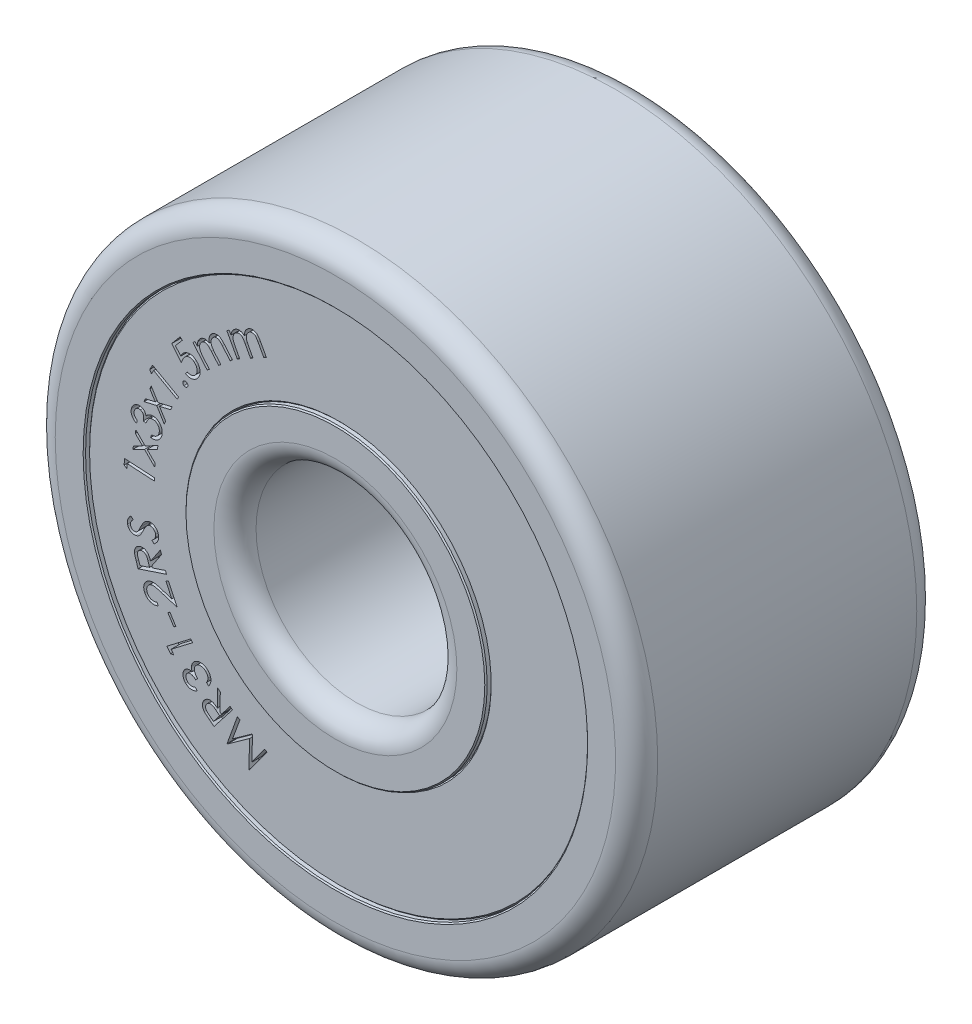
from build123d import *

# Parameters (mm, degrees)
SKETCH_R_INNER_BODY_W          = 1.5
SKETCH_R_INNER_BODY_H          = 0.25
FILLET_INNER_BODY_R            = 0.105
CHAMFER_INNER_BODY_SIZE        = 0.006
SKETCH_R_OUTER_BODY_W          = 1.5
SKETCH_R_OUTER_BODY_H          = 0.25
FILLET_OUTER_BODY_R            = 0.105
CHAMFER_OUTER_BODY_SIZE        = 0.006
SKETCH_R_SEAL_FACES_W          = 1.46
SKETCH_R_SEAL_FACES_H          = 0.5
CHAMFER_SEALS_SIZE             = 0.006
CUT_EXTRUDE_SEAL_LABEL_1_DEPTH = 0.05
CUT_EXTRUDE_SEAL_LABEL_2_DEPTH = 0.05


with BuildPart() as part:
    # Sketch R, INNER BODY → Revolve INNER BODY (revolve)
    with BuildSketch(Plane(origin=(0, 0, 0), x_dir=(0, 0, -1), z_dir=(1, 0, 0)), mode=Mode.PRIVATE) as revolve_inner_body_sk:
        with Locations((0, 0.625)):
            Rectangle(SKETCH_R_INNER_BODY_W, SKETCH_R_INNER_BODY_H)
    revolve(revolve_inner_body_sk.sketch.rotate(Axis((0, 0, 17.5), (0, 0, -1)), 90), axis=Axis((0, 0, 17.5), (0, 0, -1)))

    # Fillet INNER BODY
    fillet_inner_body_edges = [part.edges().sort_by_distance(p)[0] for p in [
        (-0.5, 0, -0.75),
        (-0.5, 0, 0.75),
    ]]
    fillet(fillet_inner_body_edges, radius=FILLET_INNER_BODY_R)

    # Chamfer INNER BODY
    chamfer_inner_body_edges = [part.edges().sort_by_distance(p)[0] for p in [
        (-0.75, 0, 0.75),
        (-0.75, 0, -0.75),
    ]]
    chamfer(chamfer_inner_body_edges, length=CHAMFER_INNER_BODY_SIZE)


with BuildPart() as body_2:
    # Sketch R, OUTER BODY → Revolve OUTER BODY (revolve)
    with BuildSketch(Plane(origin=(0, 0, 0), x_dir=(0, 0, -1), z_dir=(1, 0, 0)), mode=Mode.PRIVATE) as revolve_outer_body_sk:
        with Locations((0, 1.375)):
            Rectangle(SKETCH_R_OUTER_BODY_W, SKETCH_R_OUTER_BODY_H)
    revolve(revolve_outer_body_sk.sketch.rotate(Axis((0, 0, 17.5), (0, 0, -1)), 90), axis=Axis((0, 0, 17.5), (0, 0, -1)))

    # Fillet OUTER BODY
    fillet_outer_body_edges = [body_2.edges().sort_by_distance(p)[0] for p in [
        (-1.5, 0, 0.75),
        (-1.5, 0, -0.75),
    ]]
    fillet(fillet_outer_body_edges, radius=FILLET_OUTER_BODY_R)

    # Chamfer OUTER BODY
    chamfer_outer_body_edges = [body_2.edges().sort_by_distance(p)[0] for p in [
        (-1.25, 0, -0.75),
        (-1.25, 0, 0.75),
    ]]
    chamfer(chamfer_outer_body_edges, length=CHAMFER_OUTER_BODY_SIZE)


with BuildPart() as body_3:
    # Sketch R, SEAL FACES → Revolve SEALS (revolve)
    with BuildSketch(Plane(origin=(0, 0, 0), x_dir=(0, 0, -1), z_dir=(1, 0, 0)), mode=Mode.PRIVATE) as revolve_seals_sk:
        with Locations((0, 1)):
            Rectangle(SKETCH_R_SEAL_FACES_W, SKETCH_R_SEAL_FACES_H)
    revolve(revolve_seals_sk.sketch.rotate(Axis((0, 0, 17.5), (0, 0, -1)), 270), axis=Axis((0, 0, 17.5), (0, 0, -1)))

    # Chamfer SEALS
    chamfer_seals_edges = [body_3.edges().sort_by_distance(p)[0] for p in [
        (0.75, 0, -0.73),
        (0.75, 0, 0.73),
        (1.25, 0, 0.73),
        (1.25, 0, -0.73),
    ]]
    chamfer(chamfer_seals_edges, length=CHAMFER_SEALS_SIZE)

    # Sketch TEXT RADIUS 1 — MANUALLY ASSIGN TEXT AND FONT SIZE (FROM EQUATIONS) → Cut-Extrude SEAL LABEL 1 (cut)
    # profile 1 of 17: a face of its own
    with BuildSketch(Plane.XY.offset(0.73)):
        with BuildLine():
            Line((-0.561171916, 0.867831899), (-0.548762061, 0.87453262))
            Line((-0.548762061, 0.87453262), (-0.539687541, 0.857765793))
            add(Edge.make_bspline(
                [(-0.539687541, 0.857765793), (-0.539413602, 0.85980566), (-0.538888587, 0.863715153), (-0.537553623, 0.869235094), (-0.535888736, 0.87418348), (-0.534373648, 0.877141897), (-0.533647878, 0.878559063)],
                knots=[0, 0, 0, 0, 1.132946328, 2.171341033, 3.124020469, 4, 4, 4, 4], degree=3))
            add(Edge.make_bspline(
                [(-0.533647878, 0.878559063), (-0.532553787, 0.880287137), (-0.530395352, 0.883696303), (-0.526366987, 0.888140635), (-0.52189929, 0.892019901), (-0.518537229, 0.894021511), (-0.516851003, 0.895025409)],
                knots=[0, 0, 0, 0, 1.029422854, 2.03085757, 3.012385559, 4, 4, 4, 4], degree=3))
            add(Edge.make_bspline(
                [(-0.516851003, 0.895025409), (-0.515670263, 0.895620969), (-0.513328964, 0.896801912), (-0.50963168, 0.898132815), (-0.505836115, 0.899016773), (-0.50199532, 0.899564905), (-0.498187423, 0.899728672), (-0.494501781, 0.899447138), (-0.490981443, 0.89882384), (-0.487570921, 0.897789016), (-0.48418568, 0.896230031), (-0.480740389, 0.894128406), (-0.477130739, 0.891496739), (-0.474805538, 0.889418485), (-0.473581772, 0.888324688)],
                knots=[0, 0, 0, 0, 1.007893942, 1.99856265, 2.987934747, 3.975299643, 4.953789903, 5.888235043, 6.788718997, 7.675491184, 8.598470306, 9.622901381, 10.748919328, 12, 12, 12, 12], degree=3))
            add(Edge.make_bspline(
                [(-0.473581772, 0.888324688), (-0.473554234, 0.889537143), (-0.473499986, 0.891925605), (-0.473204046, 0.895449584), (-0.472682397, 0.89885804), (-0.472003281, 0.902151889), (-0.471125562, 0.905322247), (-0.470073646, 0.908378093), (-0.468817707, 0.911310711), (-0.466891928, 0.915023071), (-0.464123903, 0.919354653), (-0.46011298, 0.923912925), (-0.455569456, 0.927889758), (-0.452123179, 0.929932447), (-0.450384657, 0.930962909)],
                knots=[0, 0, 0, 0, 0.855519476, 1.685320073, 2.492825945, 3.286956377, 4.056723802, 4.812084644, 5.565525887, 6.305086716, 7.76143023, 9.178709332, 10.576761301, 12, 12, 12, 12], degree=3))
            add(Edge.make_bspline(
                [(-0.450384657, 0.930962909), (-0.448722719, 0.931784424), (-0.445464672, 0.933394915), (-0.440289509, 0.934920204), (-0.435078522, 0.935700921), (-0.42984681, 0.935628432), (-0.424713203, 0.934787883), (-0.41973843, 0.933194104), (-0.415047195, 0.930724042), (-0.411321782, 0.928097179), (-0.408441727, 0.925523074), (-0.406220524, 0.923227497), (-0.403953206, 0.920589108), (-0.401655961, 0.917600192), (-0.399350117, 0.914241296), (-0.396971921, 0.9105664), (-0.394529261, 0.90655337), (-0.392980677, 0.903706217), (-0.392181532, 0.902236947)],
                knots=[0, 0, 0, 0, 1.202692996, 2.35774762, 3.488867218, 4.614807807, 5.742477376, 6.857930864, 7.993087118, 9.174031987, 9.810143083, 10.500470647, 11.248000588, 12.069362592, 12.94853042, 13.894416233, 14.913415839, 16, 16, 16, 16], degree=3))
            Line((-0.392181532, 0.902236947), (-0.363545714, 0.849262188))
            Line((-0.363545714, 0.849262188), (-0.376286099, 0.84235113))
            Line((-0.376286099, 0.84235113), (-0.404921916, 0.89532589))
            add(Edge.make_bspline(
                [(-0.404921916, 0.89532589), (-0.405606926, 0.896571332), (-0.40692364, 0.898965301), (-0.408913706, 0.902351835), (-0.41076296, 0.905422124), (-0.412526466, 0.908143086), (-0.414246857, 0.910480964), (-0.415838601, 0.912496169), (-0.417291846, 0.914212668), (-0.419171354, 0.915954865), (-0.421562946, 0.917705712), (-0.424633002, 0.919353189), (-0.427991643, 0.920383504), (-0.431530367, 0.92096143), (-0.435201099, 0.92099292), (-0.438927679, 0.920431914), (-0.442684342, 0.919293965), (-0.445072024, 0.918089715), (-0.446298118, 0.917471322)],
                knots=[0, 0, 0, 0, 1.262703955, 2.427150203, 3.489288599, 4.446873273, 5.306509657, 6.066671534, 6.728798716, 7.30168236, 8.339272186, 9.354217877, 10.381377087, 11.444893699, 12.530515548, 13.627853015, 14.781883155, 16, 16, 16, 16], degree=3))
            add(Edge.make_bspline(
                [(-0.446298118, 0.917471322), (-0.44775214, 0.91660514), (-0.450635202, 0.914887657), (-0.454391567, 0.911516305), (-0.457583821, 0.907585767), (-0.460166513, 0.903159739), (-0.462137113, 0.898382361), (-0.463345003, 0.893353462), (-0.463786508, 0.888151058), (-0.463553975, 0.883676679), (-0.462867061, 0.879906278), (-0.462036626, 0.876738829), (-0.460912329, 0.873252683), (-0.459503328, 0.869437032), (-0.457744539, 0.865327378), (-0.455687764, 0.860904826), (-0.453356299, 0.856153678), (-0.451617571, 0.852922378), (-0.450715186, 0.851245361)],
                knots=[0, 0, 0, 0, 1.078086967, 2.137651911, 3.200874055, 4.29826911, 5.396278353, 6.487755879, 7.585020608, 8.718245508, 9.335151436, 10.028168088, 10.806470145, 11.672089206, 12.623068298, 13.658388782, 14.784723943, 16, 16, 16, 16], degree=3))
            Line((-0.450715186, 0.851245361), (-0.430162301, 0.813234543))
            Line((-0.430162301, 0.813234543), (-0.442572157, 0.806503774))
            Line((-0.442572157, 0.806503774), (-0.469435138, 0.856203293))
            add(Edge.make_bspline(
                [(-0.469435138, 0.856203293), (-0.470199448, 0.857609394), (-0.47166034, 0.860296995), (-0.473867664, 0.864096567), (-0.475937996, 0.867508138), (-0.477837328, 0.870563476), (-0.479686703, 0.873183609), (-0.481389282, 0.875428927), (-0.482939452, 0.877327675), (-0.48488981, 0.879263184), (-0.487340433, 0.881242755), (-0.490554267, 0.882999635), (-0.493986224, 0.884253689), (-0.497618759, 0.884931083), (-0.501373036, 0.885069841), (-0.505153823, 0.884533557), (-0.508945898, 0.88341268), (-0.511347471, 0.882231977), (-0.512584176, 0.881623966)],
                knots=[0, 0, 0, 0, 1.336305489, 2.554195278, 3.66867879, 4.668704831, 5.557365218, 6.345224332, 7.021997584, 7.601559619, 8.637353205, 9.640591628, 10.645954342, 11.676059688, 12.713675014, 13.768738341, 14.85099789, 16, 16, 16, 16], degree=3))
            add(Edge.make_bspline(
                [(-0.512584176, 0.881623966), (-0.513976591, 0.88078535), (-0.516738873, 0.879121698), (-0.520362292, 0.875854409), (-0.523474666, 0.872024752), (-0.52607598, 0.867688332), (-0.528043974, 0.862970162), (-0.529333012, 0.857993464), (-0.529870815, 0.852829384), (-0.529681102, 0.848380591), (-0.529143343, 0.844658914), (-0.52838359, 0.841619609), (-0.527432649, 0.83834439), (-0.526182859, 0.834835517), (-0.524642439, 0.831107924), (-0.522871346, 0.82711886), (-0.520790535, 0.822932668), (-0.519281355, 0.820082099), (-0.518503647, 0.818613149)],
                knots=[0, 0, 0, 0, 1.089941684, 2.162232425, 3.25725062, 4.39503195, 5.547166843, 6.679743556, 7.836682095, 9.021842795, 9.661302689, 10.359808926, 11.124173149, 11.952003323, 12.860382206, 13.833233437, 14.883425913, 16, 16, 16, 16], degree=3))
            Line((-0.518503647, 0.818613149), (-0.49626807, 0.777477332))
            Line((-0.49626807, 0.777477332), (-0.508677926, 0.770776611))
            Line((-0.508677926, 0.770776611), (-0.561171916, 0.867831899))
        make_face()
    # profile 2 of 17: a face of its own
    with BuildSketch(Plane.XY.offset(0.73)):
        with BuildLine():
            Line((-0.729509175, 0.731539249), (-0.71881206, 0.740643817))
            Line((-0.71881206, 0.740643817), (-0.7064623, 0.726160644))
            add(Edge.make_bspline(
                [(-0.7064623, 0.726160644), (-0.706621492, 0.728212978), (-0.706925702, 0.732134909), (-0.706748636, 0.7377937), (-0.706206382, 0.742974177), (-0.70530309, 0.746171335), (-0.704869752, 0.747705115)],
                knots=[0, 0, 0, 0, 1.135219144, 2.169360364, 3.121782839, 4, 4, 4, 4], degree=3))
            add(Edge.make_bspline(
                [(-0.704869752, 0.747705115), (-0.704161666, 0.749622104), (-0.702770214, 0.753389155), (-0.699787506, 0.758575145), (-0.69622176, 0.763265907), (-0.693352895, 0.765913229), (-0.691919031, 0.767236365)],
                knots=[0, 0, 0, 0, 1.032230273, 2.028422137, 3.014601769, 4, 4, 4, 4], degree=3))
            add(Edge.make_bspline(
                [(-0.691919031, 0.767236365), (-0.690893123, 0.768059098), (-0.688845306, 0.769701355), (-0.685520737, 0.771761727), (-0.682006722, 0.77343156), (-0.678374802, 0.774748742), (-0.674685859, 0.775657082), (-0.671046081, 0.776241647), (-0.667484291, 0.776308886), (-0.663938015, 0.776028174), (-0.660312172, 0.775195357), (-0.656492866, 0.773897143), (-0.652446774, 0.772028027), (-0.649740651, 0.770501899), (-0.648319271, 0.769700307)],
                knots=[0, 0, 0, 0, 1.004964279, 2.006009869, 2.982372572, 3.975711588, 4.954684449, 5.884073181, 6.788153086, 7.672287117, 8.597754093, 9.624718013, 10.752393362, 12, 12, 12, 12], degree=3))
            add(Edge.make_bspline(
                [(-0.648319271, 0.769700307), (-0.648539486, 0.770890438), (-0.648972858, 0.773232555), (-0.649444481, 0.776730115), (-0.649630213, 0.780153995), (-0.649692513, 0.783496013), (-0.649453854, 0.786755347), (-0.64909054, 0.78995354), (-0.648439093, 0.793069144), (-0.647378111, 0.797104179), (-0.645531724, 0.801885398), (-0.642575292, 0.807171521), (-0.638979115, 0.81199837), (-0.636035439, 0.814705225), (-0.634557252, 0.81606449)],
                knots=[0, 0, 0, 0, 0.856914002, 1.686363576, 2.496304063, 3.283479745, 4.050956338, 4.808275092, 5.560664027, 6.302044508, 7.76121653, 9.173898035, 10.580854563, 12, 12, 12, 12], degree=3))
            add(Edge.make_bspline(
                [(-0.634557252, 0.81606449), (-0.633095627, 0.817220514), (-0.630243368, 0.819476414), (-0.625507967, 0.822063734), (-0.620568841, 0.823846504), (-0.615464929, 0.824880427), (-0.610287341, 0.825117877), (-0.605115122, 0.824580009), (-0.600012806, 0.823194111), (-0.595848993, 0.821384592), (-0.592511849, 0.819473363), (-0.589868875, 0.817686164), (-0.587107898, 0.815582322), (-0.584254408, 0.813139119), (-0.581299178, 0.810349361), (-0.578227406, 0.807238186), (-0.575029654, 0.803810735), (-0.572929995, 0.801368667), (-0.571846916, 0.800108961)],
                knots=[0, 0, 0, 0, 1.212522353, 2.366153014, 3.497417146, 4.622395747, 5.746067543, 6.861675515, 7.99667925, 9.177492225, 9.808856064, 10.500264946, 11.254679421, 12.069400805, 12.946597164, 13.901814498, 14.917680461, 16, 16, 16, 16], degree=3))
            Line((-0.571846916, 0.800108961), (-0.532934656, 0.754375788))
            Line((-0.532934656, 0.754375788), (-0.543932252, 0.745000788))
            Line((-0.543932252, 0.745000788), (-0.582844512, 0.790733961))
            add(Edge.make_bspline(
                [(-0.582844512, 0.790733961), (-0.583773346, 0.79180796), (-0.585555881, 0.79386908), (-0.588159113, 0.796794154), (-0.590621498, 0.799372618), (-0.592911242, 0.801642601), (-0.595042539, 0.803601959), (-0.597012314, 0.805253582), (-0.598809957, 0.806593937), (-0.600976555, 0.807914946), (-0.603646521, 0.809157575), (-0.607007163, 0.810020806), (-0.610491509, 0.810390095), (-0.614067489, 0.81019767), (-0.617659665, 0.809482982), (-0.621186517, 0.808164549), (-0.624613283, 0.806260427), (-0.626696994, 0.804597975), (-0.627766387, 0.803744778)],
                knots=[0, 0, 0, 0, 1.265496125, 2.428624534, 3.489346951, 4.442485142, 5.301756917, 6.06866268, 6.73283755, 7.29775587, 8.328339365, 9.343812217, 10.375940931, 11.439551612, 12.523201375, 13.627536957, 14.782415149, 16, 16, 16, 16], degree=3))
            add(Edge.make_bspline(
                [(-0.627766387, 0.803744778), (-0.629010216, 0.802601749), (-0.631475026, 0.800336685), (-0.634424238, 0.796262725), (-0.636745657, 0.791790202), (-0.638344184, 0.786938233), (-0.639245267, 0.781869258), (-0.639412623, 0.776711666), (-0.638740908, 0.771546152), (-0.63761319, 0.76722189), (-0.636157711, 0.763676376), (-0.63471416, 0.760744682), (-0.632896458, 0.757574412), (-0.630675788, 0.754195437), (-0.628162509, 0.750515774), (-0.625245183, 0.746616549), (-0.621917875, 0.742511446), (-0.619576604, 0.73969953), (-0.618361339, 0.738239971)],
                knots=[0, 0, 0, 0, 1.078798937, 2.137781611, 3.198547607, 4.293151471, 5.393390277, 6.483574521, 7.581570305, 8.716660756, 9.332061491, 10.031553294, 10.806748636, 11.669088591, 12.618559207, 13.658276787, 14.784500059, 16, 16, 16, 16], degree=3))
            Line((-0.618361339, 0.738239971), (-0.590446675, 0.705427471))
            Line((-0.590446675, 0.705427471), (-0.601143791, 0.696322903))
            Line((-0.601143791, 0.696322903), (-0.637622156, 0.739201509))
            add(Edge.make_bspline(
                [(-0.637622156, 0.739201509), (-0.638659208, 0.740407472), (-0.640653521, 0.74272661), (-0.643589941, 0.745991496), (-0.646320309, 0.748911445), (-0.648843223, 0.751468505), (-0.651153456, 0.753680189), (-0.653281983, 0.755512936), (-0.655212153, 0.757007341), (-0.657491428, 0.758513322), (-0.660303115, 0.759892707), (-0.663782722, 0.760956717), (-0.667382288, 0.761485209), (-0.671063644, 0.761372615), (-0.67474286, 0.760728851), (-0.678318122, 0.759426205), (-0.681809998, 0.757592725), (-0.683901268, 0.755925327), (-0.684977925, 0.755066894)],
                knots=[0, 0, 0, 0, 1.332118097, 2.561742036, 3.677496279, 4.67999526, 5.570087988, 6.355334932, 7.031512975, 7.613196629, 8.641169753, 9.641560575, 10.64997385, 11.673728118, 12.713680146, 13.764403586, 14.849039054, 16, 16, 16, 16], degree=3))
            add(Edge.make_bspline(
                [(-0.684977925, 0.755066894), (-0.686154764, 0.75395803), (-0.688495168, 0.751752809), (-0.691397544, 0.747838231), (-0.693600665, 0.743428861), (-0.695259203, 0.738676029), (-0.696216595, 0.733666418), (-0.696445199, 0.728549316), (-0.695828624, 0.723405313), (-0.694769393, 0.719109371), (-0.693452371, 0.715596629), (-0.692109136, 0.712778549), (-0.690487672, 0.709778019), (-0.688550787, 0.706609438), (-0.686284466, 0.703285826), (-0.683738287, 0.69976371), (-0.680838266, 0.696104237), (-0.678773728, 0.693633838), (-0.677706291, 0.692356557)],
                knots=[0, 0, 0, 0, 1.087658858, 2.163050455, 3.261307462, 4.39634991, 5.543497851, 6.684619069, 7.831945538, 9.021496939, 9.655551991, 10.355750247, 11.122470385, 11.952059621, 12.855827046, 13.831471104, 14.878795869, 16, 16, 16, 16], degree=3))
            Line((-0.677706291, 0.692356557), (-0.647507973, 0.656869778))
            Line((-0.647507973, 0.656869778), (-0.658205089, 0.647765211))
            Line((-0.658205089, 0.647765211), (-0.729509175, 0.731539249))
        make_face()
    # profile 3 of 17: a face of its own
    with BuildSketch(Plane.XY.offset(0.73)):
        with BuildLine():
            Line((-0.793026922, 0.723945085), (-0.78211947, 0.71481047))
            Line((-0.78211947, 0.71481047), (-0.816404326, 0.673975133))
            Line((-0.816404326, 0.673975133), (-0.78993197, 0.642034027))
            add(Edge.make_bspline(
                [(-0.78993197, 0.642034027), (-0.789248893, 0.643525295), (-0.787923493, 0.646418856), (-0.785705319, 0.650470333), (-0.783365707, 0.654116507), (-0.781636225, 0.656299638), (-0.780797355, 0.657358547)],
                knots=[0, 0, 0, 0, 1.099524704, 2.13344848, 3.094645842, 4, 4, 4, 4], degree=3))
            add(Edge.make_bspline(
                [(-0.780797355, 0.657358547), (-0.779686922, 0.658610837), (-0.777513024, 0.661062452), (-0.773940395, 0.664337246), (-0.770163121, 0.66713601), (-0.766232963, 0.669531832), (-0.762092766, 0.671432942), (-0.757791617, 0.672927414), (-0.753279184, 0.673896323), (-0.748643458, 0.674482659), (-0.743952086, 0.674556254), (-0.739298276, 0.674214038), (-0.734733423, 0.673347054), (-0.730229434, 0.67207174), (-0.725836724, 0.670235669), (-0.721515949, 0.667975696), (-0.71729089, 0.665224168), (-0.714614886, 0.663099997), (-0.713249278, 0.662015999)],
                knots=[0, 0, 0, 0, 1.057951054, 2.071155792, 3.05800254, 4.026961825, 4.976324716, 5.933788031, 6.900425856, 7.889546635, 8.884168414, 9.862563495, 10.835303957, 11.817586851, 12.817398522, 13.840180039, 14.897808706, 16, 16, 16, 16], degree=3))
            add(Edge.make_bspline(
                [(-0.713249278, 0.662015999), (-0.712327521, 0.661215859), (-0.710506961, 0.659635506), (-0.707976112, 0.657088418), (-0.70562221, 0.654452456), (-0.703489197, 0.651670556), (-0.701524846, 0.648791199), (-0.69978546, 0.645769616), (-0.698220221, 0.642653391), (-0.696432456, 0.638395678), (-0.694742855, 0.632972335), (-0.693542088, 0.626358972), (-0.693424788, 0.619716951), (-0.694047474, 0.614216157), (-0.694999341, 0.609871395), (-0.695968503, 0.60663887), (-0.697176264, 0.603462157), (-0.698583293, 0.600321529), (-0.700256468, 0.597254726), (-0.702121165, 0.594208843), (-0.704216062, 0.591198049), (-0.705784356, 0.589279632), (-0.706578605, 0.588308066)],
                knots=[0, 0, 0, 0, 0.88285087, 1.7437166, 2.595875965, 3.438023981, 4.278174163, 5.115914388, 5.958529961, 6.799710869, 8.454565936, 10.05817063, 11.645614618, 13.242952196, 14.05176472, 14.861096505, 15.682120765, 16.509167405, 17.348942464, 18.207762183, 19.092336386, 20, 20, 20, 20], degree=3))
            add(Edge.make_bspline(
                [(-0.706578605, 0.588308066), (-0.707561507, 0.587188542), (-0.709494038, 0.584987393), (-0.712670214, 0.582039123), (-0.715982766, 0.579438852), (-0.719451201, 0.577200043), (-0.723081138, 0.57533811), (-0.726848227, 0.573776166), (-0.730794571, 0.572651925), (-0.734847135, 0.571872972), (-0.738949675, 0.571444718), (-0.743043765, 0.571421701), (-0.747096317, 0.571751728), (-0.751098461, 0.572445847), (-0.755065321, 0.573499448), (-0.758968413, 0.574957999), (-0.762850176, 0.576756565), (-0.765325125, 0.57823884), (-0.766584614, 0.578993162)],
                knots=[0, 0, 0, 0, 1.072496443, 2.108685047, 3.116016703, 4.10259632, 5.077046759, 6.05101637, 7.035060468, 8.026901601, 9.020420533, 10.001604339, 10.971584614, 11.945340448, 12.923575796, 13.923335371, 14.943196254, 16, 16, 16, 16], degree=3))
            Line((-0.766584614, 0.578993162), (-0.756698797, 0.590772008))
            add(Edge.make_bspline(
                [(-0.756698797, 0.590772008), (-0.755438024, 0.590127232), (-0.753014092, 0.588887599), (-0.749316297, 0.587471768), (-0.745728142, 0.586607331), (-0.742239478, 0.586149646), (-0.73878986, 0.586220054), (-0.735348391, 0.586758127), (-0.731870811, 0.587647034), (-0.728434386, 0.589015648), (-0.725113455, 0.590723557), (-0.722004714, 0.592793483), (-0.719167245, 0.59519277), (-0.717506393, 0.597032363), (-0.716674758, 0.597953499)],
                knots=[0, 0, 0, 0, 1.149293788, 2.209606258, 3.205662792, 4.139701188, 5.058786582, 5.996111554, 6.962615511, 7.966871268, 8.992563814, 9.989483109, 10.99327779, 12, 12, 12, 12], degree=3))
            add(Edge.make_bspline(
                [(-0.716674758, 0.597953499), (-0.71592543, 0.598901629), (-0.714445053, 0.600774759), (-0.71256077, 0.603792167), (-0.711102475, 0.606965923), (-0.709943046, 0.610241878), (-0.709116703, 0.613642295), (-0.70871904, 0.617183141), (-0.708621197, 0.620834069), (-0.708895047, 0.624567722), (-0.709525528, 0.628297921), (-0.710476192, 0.63193475), (-0.711791776, 0.635434342), (-0.713428531, 0.63880043), (-0.715478521, 0.641998236), (-0.717822654, 0.6450793), (-0.720534953, 0.648003178), (-0.722558084, 0.64978349), (-0.723585816, 0.650687874)],
                knots=[0, 0, 0, 0, 0.978912495, 1.933944233, 2.874447548, 3.803746025, 4.7467678, 5.70321269, 6.685652204, 7.702883716, 8.731707251, 9.747610172, 10.744165154, 11.756950405, 12.774797019, 13.817044847, 14.891077983, 16, 16, 16, 16], degree=3))
            add(Edge.make_bspline(
                [(-0.723585816, 0.650687874), (-0.724543727, 0.651457628), (-0.726429183, 0.652972737), (-0.729435361, 0.654883889), (-0.732491934, 0.656466275), (-0.735601833, 0.657703819), (-0.738768967, 0.658622748), (-0.742006555, 0.659153739), (-0.745298785, 0.65937626), (-0.748621536, 0.659212962), (-0.75191472, 0.658741768), (-0.755141379, 0.657923855), (-0.758259773, 0.656745281), (-0.761292186, 0.655242444), (-0.764184763, 0.65333968), (-0.767022256, 0.651155893), (-0.769731543, 0.648581782), (-0.771406945, 0.64667498), (-0.772263701, 0.645699893)],
                knots=[0, 0, 0, 0, 1.069743425, 2.105577751, 3.096686608, 4.063891077, 5.01662482, 5.96326716, 6.916200617, 7.885606139, 8.855404181, 9.809734462, 10.778786581, 11.754219391, 12.751262512, 13.78962895, 14.8696758, 16, 16, 16, 16], degree=3))
            add(Edge.make_bspline(
                [(-0.772263701, 0.645699893), (-0.772966692, 0.644817358), (-0.774415911, 0.642998006), (-0.776420149, 0.64001301), (-0.778338426, 0.636722451), (-0.780195517, 0.633153582), (-0.781979577, 0.629286747), (-0.783643689, 0.62511792), (-0.785242027, 0.620655966), (-0.78621636, 0.617568314), (-0.786716826, 0.615982345)],
                knots=[0, 0, 0, 0, 0.814004859, 1.678075476, 2.591727332, 3.561633421, 4.580406376, 5.663607227, 6.799914686, 8, 8, 8, 8], degree=3))
            Line((-0.786716826, 0.615982345), (-0.834673557, 0.674305662))
            Line((-0.834673557, 0.674305662), (-0.793026922, 0.723945085))
        make_face()
    # profile 4 of 17: a face of its own
    with BuildSketch(Plane.XY.offset(0.73)):
        with BuildLine():
            add(Edge.make_bspline(
                [(-0.777534901, 0.540436862), (-0.777031806, 0.541104386), (-0.776041757, 0.542418016), (-0.774086668, 0.543916209), (-0.771924855, 0.545074604), (-0.76951983, 0.545703763), (-0.767045307, 0.545930233), (-0.764595272, 0.545650526), (-0.762215918, 0.544902205), (-0.760801681, 0.544015993), (-0.760076969, 0.543561862)],
                knots=[0, 0, 0, 0, 1.012747625, 1.993000145, 2.968772268, 3.979978698, 4.995143473, 5.976304756, 6.962976316, 8, 8, 8, 8], degree=3))
            add(Edge.make_bspline(
                [(-0.760076969, 0.543561862), (-0.759412628, 0.543056479), (-0.758100263, 0.542058123), (-0.756556784, 0.540132909), (-0.755448435, 0.537928495), (-0.754779809, 0.535530545), (-0.754525246, 0.53304496), (-0.754768769, 0.530604234), (-0.755490526, 0.528244148), (-0.75635754, 0.526848827), (-0.756801728, 0.526133978)],
                knots=[0, 0, 0, 0, 1.014656579, 2.004393836, 2.976422535, 4.004581701, 5.022758857, 6.004479466, 6.977657905, 8, 8, 8, 8], degree=3))
            add(Edge.make_bspline(
                [(-0.756801728, 0.526133978), (-0.757317995, 0.525470231), (-0.758325323, 0.524175144), (-0.760248305, 0.522629348), (-0.762454397, 0.521536823), (-0.76486584, 0.520896701), (-0.767351394, 0.520672085), (-0.769793304, 0.52094499), (-0.77214397, 0.521703839), (-0.77354383, 0.522567392), (-0.774259661, 0.523008978)],
                knots=[0, 0, 0, 0, 1.022202317, 1.994496069, 2.977156368, 4.001761216, 5.018555404, 6.001291523, 6.977943472, 8, 8, 8, 8], degree=3))
            add(Edge.make_bspline(
                [(-0.774259661, 0.523008978), (-0.77493469, 0.523523813), (-0.776257197, 0.52453247), (-0.777815071, 0.526480619), (-0.778938639, 0.528679751), (-0.779631383, 0.531077846), (-0.779828537, 0.533547186), (-0.779606496, 0.535982065), (-0.778837124, 0.538320915), (-0.7779755, 0.539720945), (-0.777534901, 0.540436862)],
                knots=[0, 0, 0, 0, 1.030256292, 2.01846447, 3.005393316, 4.020241408, 5.035748373, 6.003821812, 6.979237357, 8, 8, 8, 8], degree=3))
        make_face()
    # profile 5 of 17: a face of its own
    with BuildSketch(Plane.XY.offset(0.73)):
        Polygon((-0.944487312, 0.507583156), (-0.930184428, 0.533093973), (-0.800346687, 0.460227387), (-0.807588274, 0.447336762), (-0.924715678, 0.513081954), (-0.936133947, 0.492709358), align=None)
    # profile 6 of 17: a face of its own
    with BuildSketch(Plane.XY.offset(0.73)):
        Polygon((-0.972767083, 0.354513619), (-0.966216603, 0.37028886), (-0.917118045, 0.381586937), (-0.943680545, 0.424375398), (-0.937130064, 0.440150639), (-0.903115641, 0.385042466), (-0.83313367, 0.402049677), (-0.839774295, 0.386094148), (-0.895693766, 0.372662658), (-0.865615641, 0.324014821), (-0.872136074, 0.308329725), (-0.909636074, 0.369357369), align=None)
    # profile 7 of 17: a face of its own
    with BuildSketch(Plane.XY.offset(0.73)):
        with BuildLine():
            Line((-1.006326426, 0.256198437), (-1.010503108, 0.241534975))
            add(Edge.make_bspline(
                [(-1.010503108, 0.241534975), (-1.011846757, 0.242297471), (-1.014476295, 0.243789685), (-1.018157419, 0.246306989), (-1.021531018, 0.2489583), (-1.024534266, 0.251822706), (-1.027307588, 0.254742658), (-1.02968445, 0.257904756), (-1.031757807, 0.261200562), (-1.033511247, 0.264639192), (-1.03491174, 0.268175273), (-1.036003765, 0.271762538), (-1.036758412, 0.275392422), (-1.037193161, 0.279073171), (-1.037228885, 0.282794744), (-1.037003808, 0.286556121), (-1.036396409, 0.290357159), (-1.035744236, 0.292871829), (-1.035412964, 0.294149158)],
                knots=[0, 0, 0, 0, 1.170058808, 2.289818504, 3.375422841, 4.416924668, 5.43179409, 6.422893049, 7.408281254, 8.378919377, 9.342800028, 10.28627047, 11.216463188, 12.148356867, 13.089474397, 14.03242587, 15.000568928, 16, 16, 16, 16], degree=3))
            add(Edge.make_bspline(
                [(-1.035412964, 0.294149158), (-1.034829742, 0.295980735), (-1.033676281, 0.299603119), (-1.031119108, 0.304679847), (-1.028052023, 0.309401938), (-1.024417801, 0.313682558), (-1.020360576, 0.317457146), (-1.015948262, 0.320620802), (-1.011222377, 0.323080113), (-1.006264097, 0.324799657), (-1.001227367, 0.325896799), (-0.99621583, 0.326287933), (-0.991277605, 0.326026181), (-0.988109291, 0.325267683), (-0.986524743, 0.32488834)],
                knots=[0, 0, 0, 0, 1.079171352, 2.134320644, 3.183850629, 4.238654288, 5.28261065, 6.291977001, 7.281755693, 8.266588673, 9.234060039, 10.171655985, 11.085602545, 12, 12, 12, 12], degree=3))
            add(Edge.make_bspline(
                [(-0.986524743, 0.32488834), (-0.985024222, 0.324412815), (-0.982077583, 0.323479003), (-0.978029342, 0.3213223), (-0.974367333, 0.318719488), (-0.971126865, 0.315583407), (-0.968277968, 0.311947802), (-0.965881149, 0.307778015), (-0.963838382, 0.303128087), (-0.962887014, 0.299781925), (-0.962396137, 0.298055408)],
                knots=[0, 0, 0, 0, 0.994216678, 1.952387627, 2.888076112, 3.829371545, 4.795474853, 5.800960477, 6.865363103, 8, 8, 8, 8], degree=3))
            add(Edge.make_bspline(
                [(-0.962396137, 0.298055408), (-0.961180187, 0.299512163), (-0.958785132, 0.302381531), (-0.954612723, 0.306040111), (-0.950145253, 0.309193132), (-0.946877034, 0.310741003), (-0.945238685, 0.311516946)],
                knots=[0, 0, 0, 0, 1.032287457, 2.033295948, 3.014096961, 4, 4, 4, 4], degree=3))
            add(Edge.make_bspline(
                [(-0.945238685, 0.311516946), (-0.944074703, 0.311999065), (-0.941771151, 0.312953191), (-0.93822452, 0.313993519), (-0.93467349, 0.314708168), (-0.93114056, 0.315190298), (-0.927587503, 0.3152562), (-0.92404769, 0.315060111), (-0.920498222, 0.314512173), (-0.918171123, 0.313919987), (-0.916993493, 0.313620312)],
                knots=[0, 0, 0, 0, 1.045380228, 2.068835847, 3.06198144, 4.051080764, 5.024288635, 6.007216985, 6.991551226, 8, 8, 8, 8], degree=3))
            add(Edge.make_bspline(
                [(-0.916993493, 0.313620312), (-0.914998711, 0.31296314), (-0.911018472, 0.311651869), (-0.905418083, 0.308708931), (-0.900209781, 0.305003413), (-0.896247741, 0.301332557), (-0.893294297, 0.298123772), (-0.891271666, 0.295564238), (-0.889487886, 0.292882644), (-0.887834946, 0.290143753), (-0.886430661, 0.287270446), (-0.885194488, 0.28430406), (-0.884171177, 0.281230472), (-0.883095208, 0.277010598), (-0.882223205, 0.271591854), (-0.882100988, 0.26493724), (-0.882764197, 0.258166154), (-0.883882923, 0.253713529), (-0.884451426, 0.25145084)],
                knots=[0, 0, 0, 0, 1.287794098, 2.569568335, 3.866405446, 5.202613336, 5.877328952, 6.542930374, 7.203025794, 7.853773237, 8.505594977, 9.164572198, 9.825783927, 10.492520801, 11.837235297, 13.184394451, 14.569194355, 16, 16, 16, 16], degree=3))
            add(Edge.make_bspline(
                [(-0.884451426, 0.25145084), (-0.884918043, 0.249940005), (-0.885832761, 0.246978286), (-0.887590291, 0.242759482), (-0.889609596, 0.238829592), (-0.89190031, 0.235172369), (-0.894473608, 0.231790245), (-0.897392038, 0.228759543), (-0.900529722, 0.225962126), (-0.903951851, 0.223477316), (-0.907627517, 0.221300231), (-0.911555832, 0.219493041), (-0.915722878, 0.21804948), (-0.920129186, 0.216966623), (-0.924766091, 0.216265189), (-0.929635232, 0.215858788), (-0.934738619, 0.215875189), (-0.938208607, 0.216132942), (-0.939980272, 0.216264542)],
                knots=[0, 0, 0, 0, 1.049840578, 2.058022092, 3.031016179, 3.981644887, 4.921103252, 5.848159374, 6.771939204, 7.710101032, 8.652569886, 9.605128901, 10.577189987, 11.577614788, 12.614538001, 13.689150779, 14.820154105, 16, 16, 16, 16], degree=3))
            Line((-0.939980272, 0.216264542), (-0.935983877, 0.230327042))
            add(Edge.make_bspline(
                [(-0.935983877, 0.230327042), (-0.93477178, 0.230326663), (-0.932406163, 0.230325922), (-0.928964635, 0.230497794), (-0.925722839, 0.230856454), (-0.922702429, 0.231393086), (-0.919890714, 0.232083704), (-0.917292991, 0.232919247), (-0.914897593, 0.233927972), (-0.913439801, 0.234778676), (-0.912726666, 0.235194831)],
                knots=[0, 0, 0, 0, 1.208472044, 2.358542757, 3.433854342, 4.458438081, 5.415214435, 6.318475018, 7.177417764, 8, 8, 8, 8], degree=3))
            add(Edge.make_bspline(
                [(-0.912726666, 0.235194831), (-0.911884247, 0.235770786), (-0.910202868, 0.236920331), (-0.907877767, 0.238914929), (-0.905775205, 0.24114945), (-0.903861902, 0.24359707), (-0.902189796, 0.246290098), (-0.900681767, 0.249177684), (-0.899373171, 0.252290871), (-0.898705132, 0.254479055), (-0.898363685, 0.255597475)],
                knots=[0, 0, 0, 0, 0.959076977, 1.914215222, 2.873569616, 3.840017129, 4.83035353, 5.849774983, 6.900981998, 8, 8, 8, 8], degree=3))
            add(Edge.make_bspline(
                [(-0.898363685, 0.255597475), (-0.898032594, 0.256874853), (-0.897383259, 0.25938004), (-0.896778273, 0.263140631), (-0.896543456, 0.266791174), (-0.89660303, 0.270338429), (-0.897115427, 0.273764258), (-0.8978749, 0.277096799), (-0.899036443, 0.280308454), (-0.900534317, 0.283380448), (-0.902300872, 0.286258791), (-0.90421921, 0.288938413), (-0.906365017, 0.291316031), (-0.908688204, 0.293431455), (-0.911198056, 0.295289831), (-0.913918289, 0.296827748), (-0.916780899, 0.29820083), (-0.918816647, 0.29882228), (-0.91984806, 0.299137139)],
                knots=[0, 0, 0, 0, 1.168316995, 2.29129839, 3.367035267, 4.405285705, 5.426493817, 6.429193768, 7.428119427, 8.443802756, 9.450966308, 10.416237607, 11.35848857, 12.281628888, 13.195386976, 14.11746109, 15.046210671, 16, 16, 16, 16], degree=3))
            add(Edge.make_bspline(
                [(-0.91984806, 0.299137139), (-0.921243143, 0.299472847), (-0.924016279, 0.300140165), (-0.928317417, 0.300337319), (-0.932650422, 0.299997199), (-0.936950803, 0.298951065), (-0.941100701, 0.29738485), (-0.944984985, 0.295252079), (-0.948509843, 0.29256016), (-0.951159594, 0.289870067), (-0.953156031, 0.28741115), (-0.954626686, 0.285220563), (-0.956085134, 0.282739175), (-0.957527495, 0.279955552), (-0.958965256, 0.276886088), (-0.960410193, 0.273523468), (-0.961815332, 0.269848607), (-0.962713009, 0.267288456), (-0.963177387, 0.265964062)],
                knots=[0, 0, 0, 0, 1.122463034, 2.23122418, 3.357852822, 4.519471798, 5.687388005, 6.825880805, 7.979993882, 9.151361767, 9.776682121, 10.460434375, 11.217143263, 12.031825978, 12.916859216, 13.873513361, 14.899945222, 16, 16, 16, 16], degree=3))
            Line((-0.963177387, 0.265964062), (-0.976368493, 0.269720071))
            add(Edge.make_bspline(
                [(-0.976368493, 0.269720071), (-0.9759563, 0.271335985), (-0.975144032, 0.274520307), (-0.974488215, 0.279335263), (-0.974335978, 0.284057076), (-0.974652687, 0.288611411), (-0.975432727, 0.292866649), (-0.97653387, 0.296740482), (-0.978135182, 0.300101955), (-0.980123288, 0.302975383), (-0.982412458, 0.305404554), (-0.985011258, 0.307361182), (-0.987812249, 0.308979325), (-0.989855336, 0.309648382), (-0.990881714, 0.309984494)],
                knots=[0, 0, 0, 0, 1.260554012, 2.484050598, 3.666447333, 4.828502188, 5.929569893, 6.933812447, 7.865639104, 8.73141179, 9.567338084, 10.377960127, 11.185141227, 12, 12, 12, 12], degree=3))
            add(Edge.make_bspline(
                [(-0.990881714, 0.309984494), (-0.991659293, 0.310184005), (-0.993189916, 0.310576733), (-0.995532083, 0.310828734), (-0.997849371, 0.310877918), (-1.00016356, 0.310613899), (-1.002468034, 0.310154997), (-1.004742799, 0.309372933), (-1.00701313, 0.308383446), (-1.009237861, 0.307121648), (-1.011388154, 0.305678446), (-1.013365881, 0.303998342), (-1.015155475, 0.302137374), (-1.016806269, 0.300110517), (-1.018231991, 0.297881445), (-1.019512595, 0.295486343), (-1.020595225, 0.292899019), (-1.021155338, 0.291079473), (-1.021440608, 0.290152764)],
                knots=[0, 0, 0, 0, 0.949553679, 1.869146358, 2.782598117, 3.689091613, 4.621976638, 5.559750833, 6.531712053, 7.551362004, 8.584447018, 9.594460737, 10.617898532, 11.638651851, 12.684932199, 13.746234088, 14.852139869, 16, 16, 16, 16], degree=3))
            add(Edge.make_bspline(
                [(-1.021440608, 0.290152764), (-1.021817808, 0.288639119), (-1.022554699, 0.285682091), (-1.022684534, 0.281163348), (-1.022207923, 0.276781459), (-1.021119225, 0.273254698), (-1.019819188, 0.270544984), (-1.018665775, 0.268458805), (-1.017197215, 0.266417492), (-1.015498213, 0.264372205), (-1.013590037, 0.262285699), (-1.01136484, 0.260270978), (-1.008980643, 0.258165298), (-1.007228231, 0.256866703), (-1.006326426, 0.256198437)],
                knots=[0, 0, 0, 0, 1.400209829, 2.735423504, 4.042498365, 5.354072638, 6.031526626, 6.745992395, 7.496294905, 8.290373191, 9.138724594, 10.038034675, 10.990357107, 12, 12, 12, 12], degree=3))
        make_face()
    # profile 8 of 17: a face of its own
    with BuildSketch(Plane.XY.offset(0.73)):
        Polygon((-1.02838163, 0.120827787), (-1.025647255, 0.137714806), (-0.980394851, 0.160040527), (-1.016152062, 0.195587402), (-1.013387639, 0.212474421), (-0.967564322, 0.166591008), (-0.903321534, 0.199313364), (-0.906116005, 0.182216008), (-0.957498216, 0.156284517), (-0.916963361, 0.115809758), (-0.919727784, 0.099042931), (-0.970298697, 0.149794133), align=None)
    # profile 9 of 17: a face of its own
    with BuildSketch(Plane.XY.offset(0.73)):
        Polygon((-1.071837976, 0.031687525), (-1.070155283, 0.061014449), (-0.920966582, 0.052420699), (-0.921807928, 0.037606997), (-1.056393264, 0.0453594), (-1.057745428, 0.0219219), align=None)
    # profile 10 of 17: a face of its own
    with BuildSketch(Plane.XY.offset(0.73)):
        with BuildLine():
            Line((-0.923274095, -0.234702039), (-0.933220008, -0.223734491))
            add(Edge.make_bspline(
                [(-0.933220008, -0.223734491), (-0.931519414, -0.222271889), (-0.928270821, -0.219477928), (-0.924037692, -0.214990081), (-0.92053554, -0.210562232), (-0.91786394, -0.20610356), (-0.91590194, -0.201694365), (-0.914822295, -0.197272716), (-0.914413383, -0.192861809), (-0.914851539, -0.18998761), (-0.91507097, -0.188548193)],
                knots=[0, 0, 0, 0, 1.293679964, 2.471275941, 3.554664463, 4.5449891, 5.464131531, 6.327722635, 7.162512671, 8, 8, 8, 8], degree=3))
            add(Edge.make_bspline(
                [(-0.91507097, -0.188548193), (-0.91535074, -0.187347174), (-0.91590723, -0.184958234), (-0.917285307, -0.18154625), (-0.919070007, -0.178341929), (-0.921231196, -0.175386846), (-0.92365959, -0.172719909), (-0.92636972, -0.170467417), (-0.929290002, -0.1686359), (-0.932431417, -0.167340025), (-0.935637634, -0.166424373), (-0.9388926, -0.165969546), (-0.942151769, -0.165955057), (-0.944290501, -0.166293636), (-0.945359431, -0.166462856)],
                knots=[0, 0, 0, 0, 1.063800601, 2.116000901, 3.165459376, 4.224430184, 5.271318378, 6.272607258, 7.259290088, 8.236178069, 9.197505887, 10.132191287, 11.066476273, 12, 12, 12, 12], degree=3))
            add(Edge.make_bspline(
                [(-0.945359431, -0.166462856), (-0.946576945, -0.166758843), (-0.949030036, -0.167355209), (-0.95249738, -0.169100236), (-0.955844278, -0.171377046), (-0.957808537, -0.173329238), (-0.95882097, -0.174335452)],
                knots=[0, 0, 0, 0, 0.946285922, 1.906610893, 2.921009361, 4, 4, 4, 4], degree=3))
            add(Edge.make_bspline(
                [(-0.95882097, -0.174335452), (-0.959543994, -0.17511656), (-0.961062252, -0.176756785), (-0.96320712, -0.179553434), (-0.965433492, -0.182710318), (-0.967700492, -0.186260281), (-0.970056, -0.190166405), (-0.972417682, -0.194478435), (-0.974848638, -0.199158905), (-0.976446182, -0.202426877), (-0.977270489, -0.204113096)],
                knots=[0, 0, 0, 0, 0.726274729, 1.525082704, 2.403423425, 3.363135586, 4.399758231, 5.516832819, 6.718726472, 8, 8, 8, 8], degree=3))
            add(Edge.make_bspline(
                [(-0.977270489, -0.204113096), (-0.978084986, -0.205789179), (-0.979647431, -0.2090044), (-0.98198723, -0.213544277), (-0.984146273, -0.21761944), (-0.986164897, -0.221203391), (-0.988009056, -0.224315573), (-0.989699769, -0.226959926), (-0.991227059, -0.229122484), (-0.992276481, -0.230341437), (-0.992745249, -0.230885933)],
                knots=[0, 0, 0, 0, 1.44289377, 2.767896906, 3.95450189, 5.013643805, 5.952678681, 6.755110373, 7.443918382, 8, 8, 8, 8], degree=3))
            add(Edge.make_bspline(
                [(-0.992745249, -0.230885933), (-0.993482456, -0.231681554), (-0.994938766, -0.233253257), (-0.997336678, -0.23533046), (-0.999756929, -0.237262104), (-1.002341985, -0.238881414), (-1.005016429, -0.240290644), (-1.00777698, -0.24150975), (-1.01065235, -0.242439411), (-1.012613382, -0.242889416), (-1.013598614, -0.2431155)],
                knots=[0, 0, 0, 0, 1.057144942, 2.088330259, 3.090840502, 4.074659092, 5.057943961, 6.038020396, 7.014291453, 8, 8, 8, 8], degree=3))
            add(Edge.make_bspline(
                [(-1.013598614, -0.2431155), (-1.015166961, -0.243368101), (-1.018260138, -0.243866293), (-1.022932553, -0.243873728), (-1.027508417, -0.243304783), (-1.031958013, -0.24213233), (-1.036202342, -0.240378978), (-1.040107684, -0.237972926), (-1.043758948, -0.235126593), (-1.046973163, -0.231680684), (-1.049807163, -0.227847753), (-1.052108318, -0.223658736), (-1.053943844, -0.21918924), (-1.054667596, -0.216045256), (-1.055034912, -0.214449635)],
                knots=[0, 0, 0, 0, 1.01609631, 2.003999573, 2.980275481, 3.962078455, 4.942560293, 5.909582593, 6.891385567, 7.898737164, 8.917462447, 9.936793453, 10.952889762, 12, 12, 12, 12], degree=3))
            add(Edge.make_bspline(
                [(-1.055034912, -0.214449635), (-1.05531117, -0.212731517), (-1.055858068, -0.209330211), (-1.055869095, -0.204159946), (-1.055196988, -0.199052397), (-1.05409053, -0.19483573), (-1.052824178, -0.191449266), (-1.05157045, -0.188812969), (-1.050114298, -0.186061237), (-1.048301821, -0.183277575), (-1.046308855, -0.180366258), (-1.044029039, -0.177371293), (-1.04149122, -0.174295498), (-1.039657942, -0.17225549), (-1.038718806, -0.171210452)],
                knots=[0, 0, 0, 0, 1.298273348, 2.570151668, 3.845194635, 5.13724474, 5.816745242, 6.543068262, 7.316310228, 8.140295654, 9.022288948, 9.951503052, 10.950613523, 12, 12, 12, 12], degree=3))
            Line((-1.038718806, -0.171210452), (-1.027300537, -0.181366702))
            add(Edge.make_bspline(
                [(-1.027300537, -0.181366702), (-1.028047857, -0.182212817), (-1.029488026, -0.183843376), (-1.03147259, -0.186286799), (-1.033238968, -0.188596544), (-1.034824753, -0.190765738), (-1.036166562, -0.192822973), (-1.037301019, -0.194763489), (-1.038195931, -0.196584925), (-1.039124933, -0.198823512), (-1.039907409, -0.201581339), (-1.040342658, -0.204928208), (-1.04041262, -0.208328307), (-1.040046231, -0.210576444), (-1.039860633, -0.21171526)],
                knots=[0, 0, 0, 0, 1.187187047, 2.287843659, 3.309712139, 4.245297984, 5.113072954, 5.89181796, 6.607908895, 7.245639385, 8.439398016, 9.608880322, 10.788754032, 12, 12, 12, 12], degree=3))
            add(Edge.make_bspline(
                [(-1.039860633, -0.21171526), (-1.039523998, -0.213125514), (-1.038875556, -0.215842011), (-1.037042927, -0.219532203), (-1.034641866, -0.222684902), (-1.03168612, -0.225234876), (-1.028361892, -0.227145726), (-1.024765143, -0.228274689), (-1.02099239, -0.228667763), (-1.018483874, -0.22830602), (-1.017204383, -0.22812151)],
                knots=[0, 0, 0, 0, 1.110298479, 2.138707673, 3.137028201, 4.134726437, 5.11631749, 6.060060386, 7.010516842, 8, 8, 8, 8], degree=3))
            add(Edge.make_bspline(
                [(-1.017204383, -0.22812151), (-1.016418138, -0.227938571), (-1.014850209, -0.227573754), (-1.012585742, -0.22671473), (-1.010412978, -0.225625731), (-1.008284912, -0.224285669), (-1.006230088, -0.222556981), (-1.004137876, -0.220474033), (-1.002075684, -0.217925785), (-1.000765564, -0.216041143), (-1.000076979, -0.215050596)],
                knots=[0, 0, 0, 0, 0.873208519, 1.741352177, 2.614291312, 3.50172643, 4.456999031, 5.515181469, 6.694008481, 8, 8, 8, 8], degree=3))
            add(Edge.make_bspline(
                [(-1.000076979, -0.215050596), (-0.999852217, -0.214692553), (-0.999312823, -0.213833307), (-0.998497624, -0.212244056), (-0.997406504, -0.210226643), (-0.996154841, -0.207726623), (-0.994709521, -0.204768494), (-0.993057006, -0.20134284), (-0.991201766, -0.197442909), (-0.98989072, -0.194687999), (-0.989199576, -0.193235693)],
                knots=[0, 0, 0, 0, 0.41591225, 0.998122636, 1.75661736, 2.673629452, 3.749378879, 4.997154571, 6.416989849, 8, 8, 8, 8], degree=3))
            add(Edge.make_bspline(
                [(-0.989199576, -0.193235693), (-0.988357734, -0.191478203), (-0.986726269, -0.188072241), (-0.984200991, -0.183202194), (-0.981707338, -0.178722484), (-0.979264489, -0.174621729), (-0.976779028, -0.170951326), (-0.974370698, -0.167641112), (-0.971952462, -0.164729376), (-0.969531827, -0.162191464), (-0.967108015, -0.159936963), (-0.964630113, -0.157949817), (-0.962116947, -0.15617315), (-0.959549286, -0.154638877), (-0.956953624, -0.153304337), (-0.954307148, -0.152183844), (-0.951599008, -0.151310169), (-0.949759962, -0.150894445), (-0.948845008, -0.150687616)],
                knots=[0, 0, 0, 0, 1.535505629, 2.975764596, 4.321904914, 5.575308728, 6.735489749, 7.813656482, 8.799943624, 9.715481804, 10.57559095, 11.406375385, 12.216546884, 12.998907267, 13.761347554, 14.514788392, 15.261085088, 16, 16, 16, 16], degree=3))
            add(Edge.make_bspline(
                [(-0.948845008, -0.150687616), (-0.947526479, -0.1504575), (-0.94493255, -0.150004796), (-0.941010629, -0.149845924), (-0.937156197, -0.150050727), (-0.933344822, -0.150647945), (-0.929590131, -0.151686558), (-0.925896445, -0.153130221), (-0.922267829, -0.154994451), (-0.918723711, -0.157183697), (-0.915384868, -0.159731476), (-0.912301249, -0.162512696), (-0.909594369, -0.165572232), (-0.907189032, -0.168838688), (-0.905147071, -0.172356623), (-0.903463746, -0.176130505), (-0.902057332, -0.180113845), (-0.901440629, -0.18290133), (-0.901128662, -0.184311414)],
                knots=[0, 0, 0, 0, 0.990000035, 1.947616463, 2.898201668, 3.844235056, 4.797679345, 5.776760493, 6.7749746, 7.814105342, 8.856722756, 9.880285116, 10.883444716, 11.875691697, 12.87918013, 13.888106084, 14.931672386, 16, 16, 16, 16], degree=3))
            add(Edge.make_bspline(
                [(-0.901128662, -0.184311414), (-0.900935333, -0.1854111), (-0.90055026, -0.187601451), (-0.900208559, -0.190894248), (-0.90017033, -0.194158239), (-0.900292542, -0.197385314), (-0.900742632, -0.200573308), (-0.901349177, -0.203746475), (-0.902278237, -0.206867828), (-0.903378707, -0.209981624), (-0.904769036, -0.213076332), (-0.90650915, -0.216141835), (-0.908515969, -0.219247796), (-0.910876073, -0.222333666), (-0.913523746, -0.225433922), (-0.916489527, -0.228525362), (-0.91972559, -0.231668008), (-0.922070681, -0.2336731), (-0.923274095, -0.234702039)],
                knots=[0, 0, 0, 0, 0.921531345, 1.835503074, 2.728556829, 3.614155209, 4.498131258, 5.383420852, 6.278309651, 7.183149138, 8.108233958, 9.074270236, 10.090142495, 11.158327771, 12.278366197, 13.453790805, 14.69337932, 16, 16, 16, 16], degree=3))
        make_face()
    # profile 11 of 17: a face of its own
    with BuildSketch(Plane.XY.offset(0.73)):
        with BuildLine():
            Line((-1.002186581, -0.38115502), (-1.011531533, -0.353090117))
            add(Edge.make_bspline(
                [(-1.011531533, -0.353090117), (-1.01214576, -0.351208161), (-1.013320231, -0.347609654), (-1.014955785, -0.342424902), (-1.016363347, -0.337685371), (-1.017575698, -0.333403212), (-1.018540165, -0.329573697), (-1.019300771, -0.326199102), (-1.01985802, -0.323273825), (-1.020083217, -0.321460716), (-1.020185379, -0.320638193)],
                knots=[0, 0, 0, 0, 1.412586949, 2.70102326, 3.879144727, 4.94038989, 5.876423232, 6.696581512, 7.408699833, 8, 8, 8, 8], degree=3))
            add(Edge.make_bspline(
                [(-1.020185379, -0.320638193), (-1.020274168, -0.319527257), (-1.02044999, -0.317327381), (-1.020384859, -0.314048321), (-1.02003794, -0.310858547), (-1.019517457, -0.307746246), (-1.018693459, -0.30472091), (-1.017610291, -0.301778487), (-1.01627399, -0.29890995), (-1.014728128, -0.296124354), (-1.012925404, -0.293472798), (-1.01087937, -0.291021409), (-1.008646218, -0.288738747), (-1.006168018, -0.286685902), (-1.003450739, -0.284871194), (-1.00055445, -0.283192624), (-0.997417937, -0.281755856), (-0.995221401, -0.280959368), (-0.994103648, -0.280554059)],
                knots=[0, 0, 0, 0, 1.02975508, 2.039121114, 3.025811522, 3.993908284, 4.952930606, 5.919565219, 6.888900862, 7.875417496, 8.861543025, 9.847842398, 10.823348846, 11.809648219, 12.816292897, 13.840664528, 14.901177562, 16, 16, 16, 16], degree=3))
            add(Edge.make_bspline(
                [(-0.994103648, -0.280554059), (-0.992223286, -0.27998776), (-0.9885415, -0.278878936), (-0.982906536, -0.278185948), (-0.977402599, -0.278216561), (-0.972052373, -0.279099808), (-0.966940782, -0.280755545), (-0.962102869, -0.283150232), (-0.957676765, -0.286388214), (-0.954290928, -0.289650466), (-0.951759824, -0.292656269), (-0.949896706, -0.295235289), (-0.948053889, -0.298079191), (-0.946338209, -0.301256409), (-0.94460824, -0.304667457), (-0.943002521, -0.308393968), (-0.941395224, -0.312383377), (-0.940425861, -0.315175004), (-0.939926965, -0.316611751)],
                knots=[0, 0, 0, 0, 1.272280737, 2.491150774, 3.667574988, 4.833268553, 5.994514795, 7.142591651, 8.320451185, 9.538506567, 10.184252147, 10.868026902, 11.601773035, 12.381377244, 13.209736494, 14.082782866, 15.013279086, 16, 16, 16, 16], degree=3))
            Line((-0.939926965, -0.316611751), (-0.891309177, -0.244105742))
            Line((-0.891309177, -0.244105742), (-0.88547985, -0.261563674))
            Line((-0.88547985, -0.261563674), (-0.934157735, -0.333949492))
            Line((-0.934157735, -0.333949492), (-0.931483456, -0.341972328))
            Line((-0.931483456, -0.341972328), (-0.865978648, -0.320157424))
            Line((-0.865978648, -0.320157424), (-0.861291148, -0.334249972))
            Line((-0.861291148, -0.334249972), (-1.002186581, -0.38115502))
        make_face()
        with BuildLine():
            Line((-0.993082013, -0.362465117), (-0.945185379, -0.346509588))
            Line((-0.945185379, -0.346509588), (-0.953088023, -0.322230742))
            add(Edge.make_bspline(
                [(-0.953088023, -0.322230742), (-0.953472792, -0.321096887), (-0.954215073, -0.318909505), (-0.955386962, -0.315768779), (-0.956584156, -0.312894167), (-0.957789286, -0.310269272), (-0.958983038, -0.307898977), (-0.960174861, -0.305778372), (-0.961416162, -0.303941604), (-0.963029111, -0.30184085), (-0.965203347, -0.299588645), (-0.968097108, -0.297362037), (-0.971310896, -0.295697955), (-0.974735223, -0.294530763), (-0.978309506, -0.29386433), (-0.981953666, -0.293750564), (-0.985627056, -0.294154009), (-0.988002146, -0.294859823), (-0.989205812, -0.29521752)],
                knots=[0, 0, 0, 0, 1.117543379, 2.155915592, 3.128173793, 4.023351507, 4.851167862, 5.604879036, 6.291987923, 6.918416333, 8.075421056, 9.202891428, 10.31101052, 11.437395146, 12.56873468, 13.691194134, 14.829925607, 16, 16, 16, 16], degree=3))
            add(Edge.make_bspline(
                [(-0.989205812, -0.29521752), (-0.990342087, -0.295645942), (-0.992588923, -0.296493092), (-0.995688916, -0.298323257), (-0.998443109, -0.300614315), (-1.000871971, -0.303261102), (-1.002833238, -0.30623699), (-1.004379685, -0.30937621), (-1.00533344, -0.312714176), (-1.005750079, -0.315616659), (-1.005792746, -0.318107108), (-1.005618494, -0.320213415), (-1.005327341, -0.322563339), (-1.004818441, -0.325131012), (-1.004241717, -0.32794952), (-1.0033997, -0.330973838), (-1.002446244, -0.334251884), (-1.001721551, -0.336505303), (-1.001345235, -0.337675453)],
                knots=[0, 0, 0, 0, 1.155844307, 2.285532017, 3.41126001, 4.560065823, 5.695907943, 6.797496069, 7.881950625, 8.990342688, 9.582286555, 10.252225879, 11.00292705, 11.837991189, 12.746089039, 13.744116368, 14.828570924, 16, 16, 16, 16], degree=3))
            Line((-1.001345235, -0.337675453), (-0.993082013, -0.362465117))
        make_face(mode=Mode.SUBTRACT)
    # profile 12 of 17: a face of its own
    with BuildSketch(Plane.XY.offset(0.73)):
        with BuildLine():
            Line((-0.908274735, -0.47798108), (-0.902114879, -0.490961849))
            add(Edge.make_bspline(
                [(-0.902114879, -0.490961849), (-0.903785599, -0.491665485), (-0.907066599, -0.493047301), (-0.912117425, -0.494531863), (-0.917109816, -0.495578799), (-0.922074017, -0.496086509), (-0.926985146, -0.496122787), (-0.931855979, -0.49566481), (-0.936691894, -0.494736169), (-0.941431956, -0.493285065), (-0.94600857, -0.491447379), (-0.950304308, -0.489189338), (-0.954258375, -0.486509947), (-0.957949931, -0.483512987), (-0.961291598, -0.480094659), (-0.964312177, -0.476305109), (-0.96704198, -0.472144973), (-0.968559707, -0.469142925), (-0.969332428, -0.467614493)],
                knots=[0, 0, 0, 0, 1.096735904, 2.153796974, 3.181277495, 4.181062325, 5.169473511, 6.149966523, 7.138210293, 8.145323679, 9.146358149, 10.120134281, 11.077075249, 12.033612682, 12.994101261, 13.964776187, 14.963806803, 16, 16, 16, 16], degree=3))
            add(Edge.make_bspline(
                [(-0.969332428, -0.467614493), (-0.970025471, -0.466074543), (-0.971379423, -0.463066049), (-0.972831636, -0.458431708), (-0.973884344, -0.453864343), (-0.974437488, -0.4493307), (-0.97444763, -0.444828881), (-0.974052416, -0.44037085), (-0.973090721, -0.435966808), (-0.9717181, -0.431647672), (-0.969920738, -0.427513773), (-0.967815713, -0.423618681), (-0.965407811, -0.420011569), (-0.962655197, -0.416741745), (-0.959639913, -0.413726011), (-0.956271831, -0.411063663), (-0.95264697, -0.408622308), (-0.950017576, -0.407309885), (-0.948689399, -0.406646945)],
                knots=[0, 0, 0, 0, 1.126530487, 2.200824374, 3.235836217, 4.252716843, 5.242410373, 6.236499307, 7.234561156, 8.245421618, 9.25780704, 10.23924315, 11.198094357, 12.147596409, 13.088559664, 14.039943596, 15.009922504, 16, 16, 16, 16], degree=3))
            add(Edge.make_bspline(
                [(-0.948689399, -0.406646945), (-0.946764537, -0.405816262), (-0.942943872, -0.404167436), (-0.936917137, -0.402577938), (-0.930746132, -0.401804427), (-0.925461309, -0.401768783), (-0.920995796, -0.402190064), (-0.917247658, -0.402707076), (-0.913125804, -0.403426894), (-0.908642676, -0.404408716), (-0.903774729, -0.405584108), (-0.898520216, -0.406959015), (-0.892897146, -0.40859681), (-0.889032336, -0.409786706), (-0.887030745, -0.410402955)],
                knots=[0, 0, 0, 0, 1.189110843, 2.360271295, 3.524160185, 4.712754147, 5.352230524, 6.06964798, 6.860630033, 7.727312725, 8.674925924, 9.703956389, 10.810875558, 12, 12, 12, 12], degree=3))
            Line((-0.887030745, -0.410402955), (-0.834686995, -0.426809205))
            Line((-0.834686995, -0.426809205), (-0.864344447, -0.364339253))
            Line((-0.864344447, -0.364339253), (-0.851273533, -0.358149349))
            Line((-0.851273533, -0.358149349), (-0.807643726, -0.450066416))
            Line((-0.807643726, -0.450066416), (-0.888052379, -0.42485608))
            add(Edge.make_bspline(
                [(-0.888052379, -0.42485608), (-0.890004427, -0.424241781), (-0.893751907, -0.42306247), (-0.899162245, -0.421418107), (-0.904153498, -0.420061823), (-0.908696444, -0.418820101), (-0.912822788, -0.417883537), (-0.916502112, -0.417097306), (-0.919755705, -0.416598775), (-0.92347384, -0.416135685), (-0.92780134, -0.416026015), (-0.93278698, -0.416579134), (-0.937623386, -0.417725226), (-0.940651831, -0.419012758), (-0.942168966, -0.419657762)],
                knots=[0, 0, 0, 0, 1.321765426, 2.537483036, 3.651829819, 4.662363436, 5.578792807, 6.384428783, 7.091699069, 7.703948289, 8.804007499, 9.87774933, 10.936833691, 12, 12, 12, 12], degree=3))
            add(Edge.make_bspline(
                [(-0.942168966, -0.419657762), (-0.943090439, -0.42013097), (-0.944912002, -0.421066404), (-0.947439567, -0.422759447), (-0.94973934, -0.424658225), (-0.951803921, -0.426785129), (-0.953644386, -0.429143968), (-0.955259494, -0.431724389), (-0.956655105, -0.43452291), (-0.957805035, -0.437491407), (-0.958715961, -0.440563078), (-0.95927949, -0.443676663), (-0.959566095, -0.446785264), (-0.959494072, -0.449896546), (-0.959132182, -0.453005178), (-0.958468179, -0.456116331), (-0.957479003, -0.459230668), (-0.956572464, -0.461242462), (-0.956111274, -0.462265935)],
                knots=[0, 0, 0, 0, 0.996786349, 1.970442255, 2.922507512, 3.863715248, 4.818706941, 5.798077957, 6.790093848, 7.825285791, 8.859938478, 9.870072756, 10.867232294, 11.860794075, 12.860887605, 13.876669111, 14.919782701, 16, 16, 16, 16], degree=3))
            add(Edge.make_bspline(
                [(-0.956111274, -0.462265935), (-0.955580259, -0.463318872), (-0.954543461, -0.465374718), (-0.952676151, -0.468221385), (-0.950644666, -0.470835828), (-0.948334627, -0.473125201), (-0.945908609, -0.475249988), (-0.943196481, -0.477009086), (-0.940315345, -0.478548673), (-0.937237728, -0.479813517), (-0.934009725, -0.480782005), (-0.930640128, -0.481364797), (-0.927171757, -0.481685283), (-0.92358863, -0.481605962), (-0.919900841, -0.481208281), (-0.916100023, -0.480484142), (-0.912199513, -0.479393066), (-0.909601338, -0.478458341), (-0.908274735, -0.47798108)],
                knots=[0, 0, 0, 0, 1.008667683, 1.969410883, 2.909386539, 3.836963774, 4.749239139, 5.66473185, 6.596736308, 7.542481131, 8.508222771, 9.475219486, 10.464906749, 11.485311946, 12.537215453, 13.636914181, 14.79343202, 16, 16, 16, 16], degree=3))
        make_face()
    # profile 13 of 17: a face of its own
    with BuildSketch(Plane.XY.offset(0.73)):
        Polygon((-0.824566192, -0.542583416), (-0.854494077, -0.495588224), (-0.844067394, -0.488947599), (-0.81413951, -0.535942791), align=None)
    # profile 14 of 17: a face of its own
    with BuildSketch(Plane.XY.offset(0.73)):
        Polygon((-0.840868502, -0.666409267), (-0.85871706, -0.64309196), (-0.739937012, -0.552256623), (-0.730922588, -0.564035469), (-0.838074031, -0.645976575), (-0.823801194, -0.664636431), align=None)
    # profile 15 of 17: a face of its own
    with BuildSketch(Plane.XY.offset(0.73)):
        with BuildLine():
            Line((-0.718657748, -0.749229171), (-0.707990681, -0.760076527))
            add(Edge.make_bspline(
                [(-0.707990681, -0.760076527), (-0.709311645, -0.760867998), (-0.711905028, -0.762421854), (-0.715911064, -0.764363949), (-0.719883096, -0.765974132), (-0.723836184, -0.767204274), (-0.727749777, -0.768122973), (-0.73165197, -0.76866862), (-0.735534729, -0.768851538), (-0.739376597, -0.768668494), (-0.743133845, -0.768151875), (-0.746790245, -0.767351705), (-0.750313125, -0.76619286), (-0.753725021, -0.764762149), (-0.756981169, -0.762965685), (-0.760113336, -0.760882231), (-0.763146527, -0.758508623), (-0.76500785, -0.756698974), (-0.765953422, -0.755779652)],
                knots=[0, 0, 0, 0, 1.168131526, 2.29333487, 3.374520654, 4.417879459, 5.431978068, 6.422005247, 7.403593043, 8.377588121, 9.336458411, 10.278797312, 11.21384272, 12.147032632, 13.082448697, 14.031111989, 14.999783593, 16, 16, 16, 16], degree=3))
            add(Edge.make_bspline(
                [(-0.765953422, -0.755779652), (-0.767255032, -0.75436946), (-0.769830186, -0.751579486), (-0.772975079, -0.746859565), (-0.775569875, -0.741859458), (-0.777503608, -0.736577562), (-0.778763179, -0.731177497), (-0.77932547, -0.725794567), (-0.779147709, -0.720494991), (-0.778238778, -0.7153335), (-0.776698913, -0.710426618), (-0.774526944, -0.705905787), (-0.771869516, -0.701743994), (-0.769629101, -0.699367304), (-0.768507508, -0.698177489)],
                knots=[0, 0, 0, 0, 1.078638878, 2.134017648, 3.180324226, 4.243263801, 5.290708701, 6.293641378, 7.280733078, 8.264971511, 9.234834079, 10.165264362, 11.081497702, 12, 12, 12, 12], degree=3))
            add(Edge.make_bspline(
                [(-0.768507508, -0.698177489), (-0.767355107, -0.697118444), (-0.765085787, -0.695032962), (-0.761213998, -0.692587106), (-0.757163966, -0.690641699), (-0.752829682, -0.689380326), (-0.748268471, -0.688723623), (-0.743463857, -0.688684219), (-0.738428235, -0.689217929), (-0.735056463, -0.690034758), (-0.73332121, -0.690455133)],
                knots=[0, 0, 0, 0, 0.990334067, 1.950176896, 2.89032942, 3.830546262, 4.799418777, 5.802694707, 6.869175773, 8, 8, 8, 8], degree=3))
            add(Edge.make_bspline(
                [(-0.73332121, -0.690455133), (-0.733989213, -0.688686546), (-0.735306472, -0.685199004), (-0.736447097, -0.679778322), (-0.736993599, -0.674344881), (-0.736728947, -0.670743648), (-0.73659645, -0.66894071)],
                knots=[0, 0, 0, 0, 1.030585173, 2.032250006, 3.014856435, 4, 4, 4, 4], degree=3))
            add(Edge.make_bspline(
                [(-0.73659645, -0.66894071), (-0.736440114, -0.667684584), (-0.736132442, -0.665212512), (-0.735263887, -0.661619322), (-0.734157251, -0.658180011), (-0.732769515, -0.654892169), (-0.731110967, -0.651754927), (-0.729185044, -0.64877626), (-0.72698391, -0.645947708), (-0.725305725, -0.644235634), (-0.724457027, -0.643369796)],
                knots=[0, 0, 0, 0, 1.050844906, 2.068076531, 3.065373983, 4.049814263, 5.028753258, 6.009670623, 6.99344252, 8, 8, 8, 8], degree=3))
            add(Edge.make_bspline(
                [(-0.724457027, -0.643369796), (-0.722912218, -0.641960221), (-0.719823772, -0.63914214), (-0.714500547, -0.635759838), (-0.708718579, -0.63306278), (-0.702555008, -0.631063884), (-0.696153412, -0.629865453), (-0.689701429, -0.62950248), (-0.683290547, -0.630136022), (-0.676977944, -0.631612935), (-0.670835687, -0.633921073), (-0.665002781, -0.637100506), (-0.659433446, -0.64100422), (-0.656128068, -0.644184386), (-0.654445008, -0.645803691)],
                knots=[0, 0, 0, 0, 0.963140936, 1.925550263, 2.894887581, 3.900081687, 4.905891402, 5.891269601, 6.870465732, 7.866733608, 8.874123077, 9.887006478, 10.924087891, 12, 12, 12, 12], degree=3))
            add(Edge.make_bspline(
                [(-0.654445008, -0.645803691), (-0.653364442, -0.646948927), (-0.651245305, -0.64919489), (-0.648438532, -0.652793341), (-0.646028146, -0.656493914), (-0.643999013, -0.660292131), (-0.642372338, -0.664199059), (-0.641088254, -0.668193681), (-0.640267195, -0.672308293), (-0.639765566, -0.67648833), (-0.63971376, -0.680747343), (-0.640076346, -0.685043486), (-0.640862189, -0.689382972), (-0.642114893, -0.693726308), (-0.643737067, -0.698117971), (-0.645840314, -0.702518324), (-0.648353621, -0.706955354), (-0.650298521, -0.709838683), (-0.65128996, -0.711308498)],
                knots=[0, 0, 0, 0, 1.047762153, 2.054803299, 3.033158373, 3.984697783, 4.917169549, 5.847158666, 6.773003244, 7.705951685, 8.646210406, 9.603061555, 10.57219355, 11.57693632, 12.608641749, 13.685388045, 14.820095352, 16, 16, 16, 16], degree=3))
            Line((-0.65128996, -0.711308498), (-0.661536354, -0.700881816))
            add(Edge.make_bspline(
                [(-0.661536354, -0.700881816), (-0.660924586, -0.69982616), (-0.659740044, -0.697782136), (-0.658192334, -0.694707103), (-0.656946169, -0.691722193), (-0.65586537, -0.688869831), (-0.655076373, -0.686096085), (-0.654569036, -0.683410287), (-0.654276513, -0.680826401), (-0.654288791, -0.679137693), (-0.654294768, -0.67831571)],
                knots=[0, 0, 0, 0, 1.219077009, 2.36045083, 3.436781082, 4.450073193, 5.406927523, 6.313796002, 7.179234916, 8, 8, 8, 8], degree=3))
            add(Edge.make_bspline(
                [(-0.654294768, -0.67831571), (-0.654374274, -0.677301506), (-0.654533668, -0.675268236), (-0.655145904, -0.672267097), (-0.656053859, -0.669342995), (-0.657241786, -0.666486917), (-0.658708473, -0.663693434), (-0.660503551, -0.660978009), (-0.662578459, -0.658328537), (-0.664137591, -0.656659752), (-0.664931787, -0.6558097)],
                knots=[0, 0, 0, 0, 0.958121777, 1.920836663, 2.879330418, 3.840053015, 4.832396805, 5.848304029, 6.903961111, 8, 8, 8, 8], degree=3))
            add(Edge.make_bspline(
                [(-0.664931787, -0.6558097), (-0.665879932, -0.654893517), (-0.667735056, -0.65310093), (-0.670689704, -0.65071347), (-0.673734251, -0.648684509), (-0.67686697, -0.647027407), (-0.680075161, -0.645717529), (-0.683360919, -0.644783047), (-0.686726727, -0.644214285), (-0.690128646, -0.643975436), (-0.693498404, -0.64406858), (-0.696760259, -0.644450469), (-0.699866521, -0.64515057), (-0.702841418, -0.646110777), (-0.705679069, -0.647385026), (-0.708388286, -0.648940001), (-0.710931606, -0.650825622), (-0.712490339, -0.65225954), (-0.713279143, -0.652985181)],
                knots=[0, 0, 0, 0, 1.169927346, 2.289059118, 3.366630382, 4.412599441, 5.429601816, 6.437116621, 7.43833538, 8.454365756, 9.459366876, 10.426491711, 11.364785217, 12.281345167, 13.196696959, 14.120814878, 15.049029387, 16, 16, 16, 16], degree=3))
            add(Edge.make_bspline(
                [(-0.713279143, -0.652985181), (-0.714266583, -0.654027707), (-0.716232161, -0.656102936), (-0.718541959, -0.659739206), (-0.720329421, -0.66368814), (-0.721577574, -0.667914014), (-0.722286194, -0.672288731), (-0.722299041, -0.676712252), (-0.721728434, -0.681101474), (-0.720722503, -0.684741099), (-0.719531964, -0.687682996), (-0.718335124, -0.69002572), (-0.716922421, -0.692528822), (-0.715238065, -0.695167094), (-0.713270137, -0.697934755), (-0.711049414, -0.70083623), (-0.708577363, -0.703885016), (-0.706805035, -0.705925173), (-0.705887316, -0.706981575)],
                knots=[0, 0, 0, 0, 1.124795331, 2.238992689, 3.361230508, 4.517744657, 5.687355396, 6.827212698, 7.976786709, 9.151616244, 9.779307834, 10.464830415, 11.214629873, 12.034578425, 12.920072897, 13.879134657, 14.901806961, 16, 16, 16, 16], degree=3))
            Line((-0.705887316, -0.706981575), (-0.715652941, -0.716566912))
            add(Edge.make_bspline(
                [(-0.715652941, -0.716566912), (-0.716849819, -0.71539628), (-0.719197906, -0.713099685), (-0.723093647, -0.710198888), (-0.727082169, -0.707695944), (-0.731213435, -0.705772765), (-0.735276886, -0.704326432), (-0.739188842, -0.703426215), (-0.742885824, -0.703089055), (-0.746359367, -0.703395255), (-0.749578394, -0.704232557), (-0.75258187, -0.705451843), (-0.755335112, -0.707164179), (-0.756938815, -0.708599198), (-0.757750297, -0.709325325)],
                knots=[0, 0, 0, 0, 1.266777805, 2.485220166, 3.670619384, 4.827911303, 5.929240731, 6.932353177, 7.861037133, 8.729244355, 9.559115018, 10.37206314, 11.176255468, 12, 12, 12, 12], degree=3))
            add(Edge.make_bspline(
                [(-0.757750297, -0.709325325), (-0.758304283, -0.709904906), (-0.759392999, -0.711043922), (-0.760791673, -0.712941331), (-0.761961936, -0.714945699), (-0.762898307, -0.717075796), (-0.763628479, -0.719307142), (-0.764105734, -0.721656626), (-0.764337132, -0.724123433), (-0.764369425, -0.726666694), (-0.764170678, -0.729246206), (-0.763678002, -0.73177998), (-0.762956247, -0.734255854), (-0.76198645, -0.736668831), (-0.760781345, -0.739029957), (-0.759302966, -0.741307948), (-0.757571828, -0.743519852), (-0.756278495, -0.744911497), (-0.755616883, -0.745623402)],
                knots=[0, 0, 0, 0, 0.949908545, 1.866797517, 2.787524467, 3.696766449, 4.62070498, 5.566372011, 6.53306053, 7.554520681, 8.57928966, 9.594863979, 10.609604608, 11.632927292, 12.674014948, 13.74798116, 14.847965849, 16, 16, 16, 16], degree=3))
            add(Edge.make_bspline(
                [(-0.755616883, -0.745623402), (-0.754487364, -0.746684993), (-0.752276552, -0.748762849), (-0.7484647, -0.751152004), (-0.744405956, -0.752844592), (-0.740816721, -0.753623012), (-0.737821862, -0.753867119), (-0.735440512, -0.75381781), (-0.73292616, -0.753620237), (-0.730297562, -0.753154394), (-0.727548907, -0.752488271), (-0.724684571, -0.751601662), (-0.721690059, -0.750534146), (-0.719684877, -0.749671203), (-0.718657748, -0.749229171)],
                knots=[0, 0, 0, 0, 1.394457694, 2.729376328, 4.028654401, 5.340759073, 6.019988825, 6.733222772, 7.485169841, 8.291052919, 9.136226832, 10.03291343, 10.992385783, 12, 12, 12, 12], degree=3))
        make_face()
    # profile 16 of 17: a face of its own
    with BuildSketch(Plane.XY.offset(0.73)):
        with BuildLine():
            Line((-0.624347637, -0.872292801), (-0.64772504, -0.854023571))
            add(Edge.make_bspline(
                [(-0.64772504, -0.854023571), (-0.649290963, -0.852795884), (-0.652286143, -0.850447657), (-0.656520393, -0.847018509), (-0.660336792, -0.843865885), (-0.663673114, -0.84091691), (-0.666645244, -0.838281476), (-0.669157168, -0.83588373), (-0.671264665, -0.833766551), (-0.672432802, -0.832366338), (-0.672965425, -0.831727897)],
                knots=[0, 0, 0, 0, 1.415815032, 2.708065078, 3.876984778, 4.937624097, 5.87632054, 6.70304056, 7.408639329, 8, 8, 8, 8], degree=3))
            add(Edge.make_bspline(
                [(-0.672965425, -0.831727897), (-0.673651534, -0.83084715), (-0.675010774, -0.829102312), (-0.676765872, -0.826325305), (-0.678326848, -0.823513714), (-0.679542122, -0.820587111), (-0.680597883, -0.817622041), (-0.681295671, -0.814542143), (-0.68178076, -0.81139996), (-0.682035432, -0.808204314), (-0.681957821, -0.804987678), (-0.681653993, -0.801792591), (-0.680962162, -0.798652699), (-0.680044389, -0.79556221), (-0.678818135, -0.792519323), (-0.677319095, -0.789520651), (-0.675515418, -0.786559935), (-0.674103728, -0.784691124), (-0.673386098, -0.783741119)],
                knots=[0, 0, 0, 0, 1.027505832, 2.03557767, 3.021980854, 3.98481588, 4.950298001, 5.91679292, 6.88732846, 7.877003591, 8.864096508, 9.847043771, 10.827521259, 11.81964327, 12.81305069, 13.844275639, 14.904142133, 16, 16, 16, 16], degree=3))
            add(Edge.make_bspline(
                [(-0.673386098, -0.783741119), (-0.672122847, -0.782232121), (-0.669655101, -0.779284315), (-0.665358338, -0.775554071), (-0.660739797, -0.772551862), (-0.655800204, -0.770296172), (-0.650616763, -0.768869572), (-0.645259844, -0.768163586), (-0.639770724, -0.76842865), (-0.635130378, -0.76924411), (-0.631342209, -0.770350143), (-0.628355452, -0.771478092), (-0.625257659, -0.772867606), (-0.622040469, -0.774527038), (-0.618718918, -0.776453755), (-0.615271046, -0.778624299), (-0.611731841, -0.781094201), (-0.60936775, -0.782881747), (-0.608151723, -0.783801215)],
                knots=[0, 0, 0, 0, 1.272588726, 2.485985975, 3.667778908, 4.828658266, 5.986690349, 7.136924638, 8.31157892, 9.530232888, 10.178728364, 10.864111695, 11.595647936, 12.375839472, 13.206749213, 14.081136612, 15.012986477, 16, 16, 16, 16], degree=3))
            Line((-0.608151723, -0.783801215), (-0.60773105, -0.696241119))
            Line((-0.60773105, -0.696241119), (-0.593217829, -0.707569244))
            Line((-0.593217829, -0.707569244), (-0.593698598, -0.795099292))
            Line((-0.593698598, -0.795099292), (-0.586997877, -0.800327657))
            Line((-0.586997877, -0.800327657), (-0.544359656, -0.745730301))
            Line((-0.544359656, -0.745730301), (-0.532640906, -0.754894965))
            Line((-0.532640906, -0.754894965), (-0.624347637, -0.872292801))
        make_face()
        with BuildLine():
            Line((-0.627082012, -0.851649772), (-0.595922156, -0.811745926))
            Line((-0.595922156, -0.811745926), (-0.615964223, -0.795790397))
            add(Edge.make_bspline(
                [(-0.615964223, -0.795790397), (-0.61691021, -0.795051874), (-0.618739191, -0.793624006), (-0.621483869, -0.791671284), (-0.624092689, -0.789933162), (-0.626547116, -0.788391334), (-0.628874311, -0.787087978), (-0.631063185, -0.786011084), (-0.633107502, -0.785113349), (-0.635645818, -0.784291623), (-0.638713042, -0.783636853), (-0.642373259, -0.783352407), (-0.645982061, -0.783781898), (-0.649496853, -0.784704324), (-0.65283392, -0.78615444), (-0.655938685, -0.788065437), (-0.658757538, -0.790456647), (-0.66036974, -0.792341451), (-0.661186579, -0.793296407)],
                knots=[0, 0, 0, 0, 1.116083067, 2.157846863, 3.131893435, 4.031462409, 4.85303136, 5.611264896, 6.29992533, 6.927397455, 8.089420777, 9.209772161, 10.324921788, 11.452453747, 12.579023237, 13.695844724, 14.832574921, 16, 16, 16, 16], degree=3))
            add(Edge.make_bspline(
                [(-0.661186579, -0.793296407), (-0.661897995, -0.794289174), (-0.663304517, -0.796251947), (-0.664871845, -0.799508957), (-0.66593891, -0.802941298), (-0.666464831, -0.806497747), (-0.666506234, -0.810060047), (-0.666017728, -0.813533363), (-0.665034605, -0.816871133), (-0.663712735, -0.819512727), (-0.662371924, -0.821631155), (-0.661031284, -0.823292924), (-0.659457527, -0.825067834), (-0.65764879, -0.826978236), (-0.655547805, -0.828966315), (-0.653201205, -0.831079913), (-0.650574602, -0.83327113), (-0.648719737, -0.834746611), (-0.647755088, -0.835513955)],
                knots=[0, 0, 0, 0, 1.157988252, 2.289427021, 3.414492339, 4.559124784, 5.690923241, 6.785755325, 7.877981894, 8.979608743, 9.578473007, 10.255796945, 11.003753985, 11.831174063, 12.752718903, 13.749470786, 14.82958079, 16, 16, 16, 16], degree=3))
            Line((-0.647755088, -0.835513955), (-0.627082012, -0.851649772))
        make_face(mode=Mode.SUBTRACT)
    # profile 17 of 17: a face of its own
    with BuildSketch(Plane.XY.offset(0.73)):
        Polygon((-0.360150989, -0.850819354), (-0.448852912, -0.972093393), (-0.450986325, -0.970951566), (-0.446869739, -0.834803729), (-0.557146181, -0.914280893), (-0.559279595, -0.913139066), (-0.508047623, -0.771853008), (-0.495096902, -0.778764066), (-0.532356518, -0.879455172), (-0.435872143, -0.810404691), (-0.432566854, -0.812147479), (-0.436052431, -0.931798922), (-0.372801229, -0.844058537), align=None)
    extrude(amount=-CUT_EXTRUDE_SEAL_LABEL_1_DEPTH, mode=Mode.SUBTRACT)

    # Sketch TEXT RADIUS 2 — MANUALLY ASSIGN TEXT AND FONT SIZE (FROM EQUATIONS) → Cut-Extrude SEAL LABEL 2 (cut)
    # profile 1 of 17: a face of its own
    with BuildSketch(Plane(origin=(0, 0, -0.73), x_dir=(-1, 0, 0), z_dir=(0, 0, -1))):
        with BuildLine():
            Line((-0.561171916, 0.867831899), (-0.548762061, 0.87453262))
            Line((-0.548762061, 0.87453262), (-0.539687541, 0.857765793))
            add(Edge.make_bspline(
                [(-0.539687541, 0.857765793), (-0.539413602, 0.85980566), (-0.538888587, 0.863715153), (-0.537553623, 0.869235094), (-0.535888736, 0.87418348), (-0.534373648, 0.877141897), (-0.533647878, 0.878559063)],
                knots=[0, 0, 0, 0, 1.132946328, 2.171341033, 3.124020469, 4, 4, 4, 4], degree=3))
            add(Edge.make_bspline(
                [(-0.533647878, 0.878559063), (-0.532553787, 0.880287137), (-0.530395352, 0.883696303), (-0.526366987, 0.888140635), (-0.52189929, 0.892019901), (-0.518537229, 0.894021511), (-0.516851003, 0.895025409)],
                knots=[0, 0, 0, 0, 1.029422854, 2.03085757, 3.012385559, 4, 4, 4, 4], degree=3))
            add(Edge.make_bspline(
                [(-0.516851003, 0.895025409), (-0.515670263, 0.895620969), (-0.513328964, 0.896801912), (-0.50963168, 0.898132815), (-0.505836115, 0.899016773), (-0.50199532, 0.899564905), (-0.498187423, 0.899728672), (-0.494501781, 0.899447138), (-0.490981443, 0.89882384), (-0.487570921, 0.897789016), (-0.48418568, 0.896230031), (-0.480740389, 0.894128406), (-0.477130739, 0.891496739), (-0.474805538, 0.889418485), (-0.473581772, 0.888324688)],
                knots=[0, 0, 0, 0, 1.007893942, 1.99856265, 2.987934747, 3.975299643, 4.953789903, 5.888235043, 6.788718997, 7.675491184, 8.598470306, 9.622901381, 10.748919328, 12, 12, 12, 12], degree=3))
            add(Edge.make_bspline(
                [(-0.473581772, 0.888324688), (-0.473554234, 0.889537143), (-0.473499986, 0.891925605), (-0.473204046, 0.895449584), (-0.472682397, 0.89885804), (-0.472003281, 0.902151889), (-0.471125562, 0.905322247), (-0.470073646, 0.908378093), (-0.468817707, 0.911310711), (-0.466891928, 0.915023071), (-0.464123903, 0.919354653), (-0.46011298, 0.923912925), (-0.455569456, 0.927889758), (-0.452123179, 0.929932447), (-0.450384657, 0.930962909)],
                knots=[0, 0, 0, 0, 0.855519476, 1.685320073, 2.492825945, 3.286956377, 4.056723802, 4.812084644, 5.565525887, 6.305086716, 7.76143023, 9.178709332, 10.576761301, 12, 12, 12, 12], degree=3))
            add(Edge.make_bspline(
                [(-0.450384657, 0.930962909), (-0.448722719, 0.931784424), (-0.445464672, 0.933394915), (-0.440289509, 0.934920204), (-0.435078522, 0.935700921), (-0.42984681, 0.935628432), (-0.424713203, 0.934787883), (-0.41973843, 0.933194104), (-0.415047195, 0.930724042), (-0.411321782, 0.928097179), (-0.408441727, 0.925523074), (-0.406220524, 0.923227497), (-0.403953206, 0.920589108), (-0.401655961, 0.917600192), (-0.399350117, 0.914241296), (-0.396971921, 0.9105664), (-0.394529261, 0.90655337), (-0.392980677, 0.903706217), (-0.392181532, 0.902236947)],
                knots=[0, 0, 0, 0, 1.202692996, 2.35774762, 3.488867218, 4.614807807, 5.742477376, 6.857930864, 7.993087118, 9.174031987, 9.810143083, 10.500470647, 11.248000588, 12.069362592, 12.94853042, 13.894416233, 14.913415839, 16, 16, 16, 16], degree=3))
            Line((-0.392181532, 0.902236947), (-0.363545714, 0.849262188))
            Line((-0.363545714, 0.849262188), (-0.376286099, 0.84235113))
            Line((-0.376286099, 0.84235113), (-0.404921916, 0.89532589))
            add(Edge.make_bspline(
                [(-0.404921916, 0.89532589), (-0.405606926, 0.896571332), (-0.40692364, 0.898965301), (-0.408913706, 0.902351835), (-0.41076296, 0.905422124), (-0.412526466, 0.908143086), (-0.414246857, 0.910480964), (-0.415838601, 0.912496169), (-0.417291846, 0.914212668), (-0.419171354, 0.915954865), (-0.421562946, 0.917705712), (-0.424633002, 0.919353189), (-0.427991643, 0.920383504), (-0.431530367, 0.92096143), (-0.435201099, 0.92099292), (-0.438927679, 0.920431914), (-0.442684342, 0.919293965), (-0.445072024, 0.918089715), (-0.446298118, 0.917471322)],
                knots=[0, 0, 0, 0, 1.262703955, 2.427150203, 3.489288599, 4.446873273, 5.306509657, 6.066671534, 6.728798716, 7.30168236, 8.339272186, 9.354217877, 10.381377087, 11.444893699, 12.530515548, 13.627853015, 14.781883155, 16, 16, 16, 16], degree=3))
            add(Edge.make_bspline(
                [(-0.446298118, 0.917471322), (-0.44775214, 0.91660514), (-0.450635202, 0.914887657), (-0.454391567, 0.911516305), (-0.457583821, 0.907585767), (-0.460166513, 0.903159739), (-0.462137113, 0.898382361), (-0.463345003, 0.893353462), (-0.463786508, 0.888151058), (-0.463553975, 0.883676679), (-0.462867061, 0.879906278), (-0.462036626, 0.876738829), (-0.460912329, 0.873252683), (-0.459503328, 0.869437032), (-0.457744539, 0.865327378), (-0.455687764, 0.860904826), (-0.453356299, 0.856153678), (-0.451617571, 0.852922378), (-0.450715186, 0.851245361)],
                knots=[0, 0, 0, 0, 1.078086967, 2.137651911, 3.200874055, 4.29826911, 5.396278353, 6.487755879, 7.585020608, 8.718245508, 9.335151436, 10.028168088, 10.806470145, 11.672089206, 12.623068298, 13.658388782, 14.784723943, 16, 16, 16, 16], degree=3))
            Line((-0.450715186, 0.851245361), (-0.430162301, 0.813234543))
            Line((-0.430162301, 0.813234543), (-0.442572157, 0.806503774))
            Line((-0.442572157, 0.806503774), (-0.469435138, 0.856203293))
            add(Edge.make_bspline(
                [(-0.469435138, 0.856203293), (-0.470199448, 0.857609394), (-0.47166034, 0.860296995), (-0.473867664, 0.864096567), (-0.475937996, 0.867508138), (-0.477837328, 0.870563476), (-0.479686703, 0.873183609), (-0.481389282, 0.875428927), (-0.482939452, 0.877327675), (-0.48488981, 0.879263184), (-0.487340433, 0.881242755), (-0.490554267, 0.882999635), (-0.493986224, 0.884253689), (-0.497618759, 0.884931083), (-0.501373036, 0.885069841), (-0.505153823, 0.884533557), (-0.508945898, 0.88341268), (-0.511347471, 0.882231977), (-0.512584176, 0.881623966)],
                knots=[0, 0, 0, 0, 1.336305489, 2.554195278, 3.66867879, 4.668704831, 5.557365218, 6.345224332, 7.021997584, 7.601559619, 8.637353205, 9.640591628, 10.645954342, 11.676059688, 12.713675014, 13.768738341, 14.85099789, 16, 16, 16, 16], degree=3))
            add(Edge.make_bspline(
                [(-0.512584176, 0.881623966), (-0.513976591, 0.88078535), (-0.516738873, 0.879121698), (-0.520362292, 0.875854409), (-0.523474666, 0.872024752), (-0.52607598, 0.867688332), (-0.528043974, 0.862970162), (-0.529333012, 0.857993464), (-0.529870815, 0.852829384), (-0.529681102, 0.848380591), (-0.529143343, 0.844658914), (-0.52838359, 0.841619609), (-0.527432649, 0.83834439), (-0.526182859, 0.834835517), (-0.524642439, 0.831107924), (-0.522871346, 0.82711886), (-0.520790535, 0.822932668), (-0.519281355, 0.820082099), (-0.518503647, 0.818613149)],
                knots=[0, 0, 0, 0, 1.089941684, 2.162232425, 3.25725062, 4.39503195, 5.547166843, 6.679743556, 7.836682095, 9.021842795, 9.661302689, 10.359808926, 11.124173149, 11.952003323, 12.860382206, 13.833233437, 14.883425913, 16, 16, 16, 16], degree=3))
            Line((-0.518503647, 0.818613149), (-0.49626807, 0.777477332))
            Line((-0.49626807, 0.777477332), (-0.508677926, 0.770776611))
            Line((-0.508677926, 0.770776611), (-0.561171916, 0.867831899))
        make_face()
    # profile 2 of 17: a face of its own
    with BuildSketch(Plane(origin=(0, 0, -0.73), x_dir=(-1, 0, 0), z_dir=(0, 0, -1))):
        with BuildLine():
            Line((-0.729509175, 0.731539249), (-0.71881206, 0.740643817))
            Line((-0.71881206, 0.740643817), (-0.7064623, 0.726160644))
            add(Edge.make_bspline(
                [(-0.7064623, 0.726160644), (-0.706621492, 0.728212978), (-0.706925702, 0.732134909), (-0.706748636, 0.7377937), (-0.706206382, 0.742974177), (-0.70530309, 0.746171335), (-0.704869752, 0.747705115)],
                knots=[0, 0, 0, 0, 1.135219144, 2.169360364, 3.121782839, 4, 4, 4, 4], degree=3))
            add(Edge.make_bspline(
                [(-0.704869752, 0.747705115), (-0.704161666, 0.749622104), (-0.702770214, 0.753389155), (-0.699787506, 0.758575145), (-0.69622176, 0.763265907), (-0.693352895, 0.765913229), (-0.691919031, 0.767236365)],
                knots=[0, 0, 0, 0, 1.032230273, 2.028422137, 3.014601769, 4, 4, 4, 4], degree=3))
            add(Edge.make_bspline(
                [(-0.691919031, 0.767236365), (-0.690893123, 0.768059098), (-0.688845306, 0.769701355), (-0.685520737, 0.771761727), (-0.682006722, 0.77343156), (-0.678374802, 0.774748742), (-0.674685859, 0.775657082), (-0.671046081, 0.776241647), (-0.667484291, 0.776308886), (-0.663938015, 0.776028174), (-0.660312172, 0.775195357), (-0.656492866, 0.773897143), (-0.652446774, 0.772028027), (-0.649740651, 0.770501899), (-0.648319271, 0.769700307)],
                knots=[0, 0, 0, 0, 1.004964279, 2.006009869, 2.982372572, 3.975711588, 4.954684449, 5.884073181, 6.788153086, 7.672287117, 8.597754093, 9.624718013, 10.752393362, 12, 12, 12, 12], degree=3))
            add(Edge.make_bspline(
                [(-0.648319271, 0.769700307), (-0.648539486, 0.770890438), (-0.648972858, 0.773232555), (-0.649444481, 0.776730115), (-0.649630213, 0.780153995), (-0.649692513, 0.783496013), (-0.649453854, 0.786755347), (-0.64909054, 0.78995354), (-0.648439093, 0.793069144), (-0.647378111, 0.797104179), (-0.645531724, 0.801885398), (-0.642575292, 0.807171521), (-0.638979115, 0.81199837), (-0.636035439, 0.814705225), (-0.634557252, 0.81606449)],
                knots=[0, 0, 0, 0, 0.856914002, 1.686363576, 2.496304063, 3.283479745, 4.050956338, 4.808275092, 5.560664027, 6.302044508, 7.76121653, 9.173898035, 10.580854563, 12, 12, 12, 12], degree=3))
            add(Edge.make_bspline(
                [(-0.634557252, 0.81606449), (-0.633095627, 0.817220514), (-0.630243368, 0.819476414), (-0.625507967, 0.822063734), (-0.620568841, 0.823846504), (-0.615464929, 0.824880427), (-0.610287341, 0.825117877), (-0.605115122, 0.824580009), (-0.600012806, 0.823194111), (-0.595848993, 0.821384592), (-0.592511849, 0.819473363), (-0.589868875, 0.817686164), (-0.587107898, 0.815582322), (-0.584254408, 0.813139119), (-0.581299178, 0.810349361), (-0.578227406, 0.807238186), (-0.575029654, 0.803810735), (-0.572929995, 0.801368667), (-0.571846916, 0.800108961)],
                knots=[0, 0, 0, 0, 1.212522353, 2.366153014, 3.497417146, 4.622395747, 5.746067543, 6.861675515, 7.99667925, 9.177492225, 9.808856064, 10.500264946, 11.254679421, 12.069400805, 12.946597164, 13.901814498, 14.917680461, 16, 16, 16, 16], degree=3))
            Line((-0.571846916, 0.800108961), (-0.532934656, 0.754375788))
            Line((-0.532934656, 0.754375788), (-0.543932252, 0.745000788))
            Line((-0.543932252, 0.745000788), (-0.582844512, 0.790733961))
            add(Edge.make_bspline(
                [(-0.582844512, 0.790733961), (-0.583773346, 0.79180796), (-0.585555881, 0.79386908), (-0.588159113, 0.796794154), (-0.590621498, 0.799372618), (-0.592911242, 0.801642601), (-0.595042539, 0.803601959), (-0.597012314, 0.805253582), (-0.598809957, 0.806593937), (-0.600976555, 0.807914946), (-0.603646521, 0.809157575), (-0.607007163, 0.810020806), (-0.610491509, 0.810390095), (-0.614067489, 0.81019767), (-0.617659665, 0.809482982), (-0.621186517, 0.808164549), (-0.624613283, 0.806260427), (-0.626696994, 0.804597975), (-0.627766387, 0.803744778)],
                knots=[0, 0, 0, 0, 1.265496125, 2.428624534, 3.489346951, 4.442485142, 5.301756917, 6.06866268, 6.73283755, 7.29775587, 8.328339365, 9.343812217, 10.375940931, 11.439551612, 12.523201375, 13.627536957, 14.782415149, 16, 16, 16, 16], degree=3))
            add(Edge.make_bspline(
                [(-0.627766387, 0.803744778), (-0.629010216, 0.802601749), (-0.631475026, 0.800336685), (-0.634424238, 0.796262725), (-0.636745657, 0.791790202), (-0.638344184, 0.786938233), (-0.639245267, 0.781869258), (-0.639412623, 0.776711666), (-0.638740908, 0.771546152), (-0.63761319, 0.76722189), (-0.636157711, 0.763676376), (-0.63471416, 0.760744682), (-0.632896458, 0.757574412), (-0.630675788, 0.754195437), (-0.628162509, 0.750515774), (-0.625245183, 0.746616549), (-0.621917875, 0.742511446), (-0.619576604, 0.73969953), (-0.618361339, 0.738239971)],
                knots=[0, 0, 0, 0, 1.078798937, 2.137781611, 3.198547607, 4.293151471, 5.393390277, 6.483574521, 7.581570305, 8.716660756, 9.332061491, 10.031553294, 10.806748636, 11.669088591, 12.618559207, 13.658276787, 14.784500059, 16, 16, 16, 16], degree=3))
            Line((-0.618361339, 0.738239971), (-0.590446675, 0.705427471))
            Line((-0.590446675, 0.705427471), (-0.601143791, 0.696322903))
            Line((-0.601143791, 0.696322903), (-0.637622156, 0.739201509))
            add(Edge.make_bspline(
                [(-0.637622156, 0.739201509), (-0.638659208, 0.740407472), (-0.640653521, 0.74272661), (-0.643589941, 0.745991496), (-0.646320309, 0.748911445), (-0.648843223, 0.751468505), (-0.651153456, 0.753680189), (-0.653281983, 0.755512936), (-0.655212153, 0.757007341), (-0.657491428, 0.758513322), (-0.660303115, 0.759892707), (-0.663782722, 0.760956717), (-0.667382288, 0.761485209), (-0.671063644, 0.761372615), (-0.67474286, 0.760728851), (-0.678318122, 0.759426205), (-0.681809998, 0.757592725), (-0.683901268, 0.755925327), (-0.684977925, 0.755066894)],
                knots=[0, 0, 0, 0, 1.332118097, 2.561742036, 3.677496279, 4.67999526, 5.570087988, 6.355334932, 7.031512975, 7.613196629, 8.641169753, 9.641560575, 10.64997385, 11.673728118, 12.713680146, 13.764403586, 14.849039054, 16, 16, 16, 16], degree=3))
            add(Edge.make_bspline(
                [(-0.684977925, 0.755066894), (-0.686154764, 0.75395803), (-0.688495168, 0.751752809), (-0.691397544, 0.747838231), (-0.693600665, 0.743428861), (-0.695259203, 0.738676029), (-0.696216595, 0.733666418), (-0.696445199, 0.728549316), (-0.695828624, 0.723405313), (-0.694769393, 0.719109371), (-0.693452371, 0.715596629), (-0.692109136, 0.712778549), (-0.690487672, 0.709778019), (-0.688550787, 0.706609438), (-0.686284466, 0.703285826), (-0.683738287, 0.69976371), (-0.680838266, 0.696104237), (-0.678773728, 0.693633838), (-0.677706291, 0.692356557)],
                knots=[0, 0, 0, 0, 1.087658858, 2.163050455, 3.261307462, 4.39634991, 5.543497851, 6.684619069, 7.831945538, 9.021496939, 9.655551991, 10.355750247, 11.122470385, 11.952059621, 12.855827046, 13.831471104, 14.878795869, 16, 16, 16, 16], degree=3))
            Line((-0.677706291, 0.692356557), (-0.647507973, 0.656869778))
            Line((-0.647507973, 0.656869778), (-0.658205089, 0.647765211))
            Line((-0.658205089, 0.647765211), (-0.729509175, 0.731539249))
        make_face()
    # profile 3 of 17: a face of its own
    with BuildSketch(Plane(origin=(0, 0, -0.73), x_dir=(-1, 0, 0), z_dir=(0, 0, -1))):
        with BuildLine():
            Line((-0.793026922, 0.723945085), (-0.78211947, 0.71481047))
            Line((-0.78211947, 0.71481047), (-0.816404326, 0.673975133))
            Line((-0.816404326, 0.673975133), (-0.78993197, 0.642034027))
            add(Edge.make_bspline(
                [(-0.78993197, 0.642034027), (-0.789248893, 0.643525295), (-0.787923493, 0.646418856), (-0.785705319, 0.650470333), (-0.783365707, 0.654116507), (-0.781636225, 0.656299638), (-0.780797355, 0.657358547)],
                knots=[0, 0, 0, 0, 1.099524704, 2.13344848, 3.094645842, 4, 4, 4, 4], degree=3))
            add(Edge.make_bspline(
                [(-0.780797355, 0.657358547), (-0.779686922, 0.658610837), (-0.777513024, 0.661062452), (-0.773940395, 0.664337246), (-0.770163121, 0.66713601), (-0.766232963, 0.669531832), (-0.762092766, 0.671432942), (-0.757791617, 0.672927414), (-0.753279184, 0.673896323), (-0.748643458, 0.674482659), (-0.743952086, 0.674556254), (-0.739298276, 0.674214038), (-0.734733423, 0.673347054), (-0.730229434, 0.67207174), (-0.725836724, 0.670235669), (-0.721515949, 0.667975696), (-0.71729089, 0.665224168), (-0.714614886, 0.663099997), (-0.713249278, 0.662015999)],
                knots=[0, 0, 0, 0, 1.057951054, 2.071155792, 3.05800254, 4.026961825, 4.976324716, 5.933788031, 6.900425856, 7.889546635, 8.884168414, 9.862563495, 10.835303957, 11.817586851, 12.817398522, 13.840180039, 14.897808706, 16, 16, 16, 16], degree=3))
            add(Edge.make_bspline(
                [(-0.713249278, 0.662015999), (-0.712327521, 0.661215859), (-0.710506961, 0.659635506), (-0.707976112, 0.657088418), (-0.70562221, 0.654452456), (-0.703489197, 0.651670556), (-0.701524846, 0.648791199), (-0.69978546, 0.645769616), (-0.698220221, 0.642653391), (-0.696432456, 0.638395678), (-0.694742855, 0.632972335), (-0.693542088, 0.626358972), (-0.693424788, 0.619716951), (-0.694047474, 0.614216157), (-0.694999341, 0.609871395), (-0.695968503, 0.60663887), (-0.697176264, 0.603462157), (-0.698583293, 0.600321529), (-0.700256468, 0.597254726), (-0.702121165, 0.594208843), (-0.704216062, 0.591198049), (-0.705784356, 0.589279632), (-0.706578605, 0.588308066)],
                knots=[0, 0, 0, 0, 0.88285087, 1.7437166, 2.595875965, 3.438023981, 4.278174163, 5.115914388, 5.958529961, 6.799710869, 8.454565936, 10.05817063, 11.645614618, 13.242952196, 14.05176472, 14.861096505, 15.682120765, 16.509167405, 17.348942464, 18.207762183, 19.092336386, 20, 20, 20, 20], degree=3))
            add(Edge.make_bspline(
                [(-0.706578605, 0.588308066), (-0.707561507, 0.587188542), (-0.709494038, 0.584987393), (-0.712670214, 0.582039123), (-0.715982766, 0.579438852), (-0.719451201, 0.577200043), (-0.723081138, 0.57533811), (-0.726848227, 0.573776166), (-0.730794571, 0.572651925), (-0.734847135, 0.571872972), (-0.738949675, 0.571444718), (-0.743043765, 0.571421701), (-0.747096317, 0.571751728), (-0.751098461, 0.572445847), (-0.755065321, 0.573499448), (-0.758968413, 0.574957999), (-0.762850176, 0.576756565), (-0.765325125, 0.57823884), (-0.766584614, 0.578993162)],
                knots=[0, 0, 0, 0, 1.072496443, 2.108685047, 3.116016703, 4.10259632, 5.077046759, 6.05101637, 7.035060468, 8.026901601, 9.020420533, 10.001604339, 10.971584614, 11.945340448, 12.923575796, 13.923335371, 14.943196254, 16, 16, 16, 16], degree=3))
            Line((-0.766584614, 0.578993162), (-0.756698797, 0.590772008))
            add(Edge.make_bspline(
                [(-0.756698797, 0.590772008), (-0.755438024, 0.590127232), (-0.753014092, 0.588887599), (-0.749316297, 0.587471768), (-0.745728142, 0.586607331), (-0.742239478, 0.586149646), (-0.73878986, 0.586220054), (-0.735348391, 0.586758127), (-0.731870811, 0.587647034), (-0.728434386, 0.589015648), (-0.725113455, 0.590723557), (-0.722004714, 0.592793483), (-0.719167245, 0.59519277), (-0.717506393, 0.597032363), (-0.716674758, 0.597953499)],
                knots=[0, 0, 0, 0, 1.149293788, 2.209606258, 3.205662792, 4.139701188, 5.058786582, 5.996111554, 6.962615511, 7.966871268, 8.992563814, 9.989483109, 10.99327779, 12, 12, 12, 12], degree=3))
            add(Edge.make_bspline(
                [(-0.716674758, 0.597953499), (-0.71592543, 0.598901629), (-0.714445053, 0.600774759), (-0.71256077, 0.603792167), (-0.711102475, 0.606965923), (-0.709943046, 0.610241878), (-0.709116703, 0.613642295), (-0.70871904, 0.617183141), (-0.708621197, 0.620834069), (-0.708895047, 0.624567722), (-0.709525528, 0.628297921), (-0.710476192, 0.63193475), (-0.711791776, 0.635434342), (-0.713428531, 0.63880043), (-0.715478521, 0.641998236), (-0.717822654, 0.6450793), (-0.720534953, 0.648003178), (-0.722558084, 0.64978349), (-0.723585816, 0.650687874)],
                knots=[0, 0, 0, 0, 0.978912495, 1.933944233, 2.874447548, 3.803746025, 4.7467678, 5.70321269, 6.685652204, 7.702883716, 8.731707251, 9.747610172, 10.744165154, 11.756950405, 12.774797019, 13.817044847, 14.891077983, 16, 16, 16, 16], degree=3))
            add(Edge.make_bspline(
                [(-0.723585816, 0.650687874), (-0.724543727, 0.651457628), (-0.726429183, 0.652972737), (-0.729435361, 0.654883889), (-0.732491934, 0.656466275), (-0.735601833, 0.657703819), (-0.738768967, 0.658622748), (-0.742006555, 0.659153739), (-0.745298785, 0.65937626), (-0.748621536, 0.659212962), (-0.75191472, 0.658741768), (-0.755141379, 0.657923855), (-0.758259773, 0.656745281), (-0.761292186, 0.655242444), (-0.764184763, 0.65333968), (-0.767022256, 0.651155893), (-0.769731543, 0.648581782), (-0.771406945, 0.64667498), (-0.772263701, 0.645699893)],
                knots=[0, 0, 0, 0, 1.069743425, 2.105577751, 3.096686608, 4.063891077, 5.01662482, 5.96326716, 6.916200617, 7.885606139, 8.855404181, 9.809734462, 10.778786581, 11.754219391, 12.751262512, 13.78962895, 14.8696758, 16, 16, 16, 16], degree=3))
            add(Edge.make_bspline(
                [(-0.772263701, 0.645699893), (-0.772966692, 0.644817358), (-0.774415911, 0.642998006), (-0.776420149, 0.64001301), (-0.778338426, 0.636722451), (-0.780195517, 0.633153582), (-0.781979577, 0.629286747), (-0.783643689, 0.62511792), (-0.785242027, 0.620655966), (-0.78621636, 0.617568314), (-0.786716826, 0.615982345)],
                knots=[0, 0, 0, 0, 0.814004859, 1.678075476, 2.591727332, 3.561633421, 4.580406376, 5.663607227, 6.799914686, 8, 8, 8, 8], degree=3))
            Line((-0.786716826, 0.615982345), (-0.834673557, 0.674305662))
            Line((-0.834673557, 0.674305662), (-0.793026922, 0.723945085))
        make_face()
    # profile 4 of 17: a face of its own
    with BuildSketch(Plane(origin=(0, 0, -0.73), x_dir=(-1, 0, 0), z_dir=(0, 0, -1))):
        with BuildLine():
            add(Edge.make_bspline(
                [(-0.777534901, 0.540436862), (-0.777031806, 0.541104386), (-0.776041757, 0.542418016), (-0.774086668, 0.543916209), (-0.771924855, 0.545074604), (-0.76951983, 0.545703763), (-0.767045307, 0.545930233), (-0.764595272, 0.545650526), (-0.762215918, 0.544902205), (-0.760801681, 0.544015993), (-0.760076969, 0.543561862)],
                knots=[0, 0, 0, 0, 1.012747625, 1.993000145, 2.968772268, 3.979978698, 4.995143473, 5.976304756, 6.962976316, 8, 8, 8, 8], degree=3))
            add(Edge.make_bspline(
                [(-0.760076969, 0.543561862), (-0.759412628, 0.543056479), (-0.758100263, 0.542058123), (-0.756556784, 0.540132909), (-0.755448435, 0.537928495), (-0.754779809, 0.535530545), (-0.754525246, 0.53304496), (-0.754768769, 0.530604234), (-0.755490526, 0.528244148), (-0.75635754, 0.526848827), (-0.756801728, 0.526133978)],
                knots=[0, 0, 0, 0, 1.014656579, 2.004393836, 2.976422535, 4.004581701, 5.022758857, 6.004479466, 6.977657905, 8, 8, 8, 8], degree=3))
            add(Edge.make_bspline(
                [(-0.756801728, 0.526133978), (-0.757317995, 0.525470231), (-0.758325323, 0.524175144), (-0.760248305, 0.522629348), (-0.762454397, 0.521536823), (-0.76486584, 0.520896701), (-0.767351394, 0.520672085), (-0.769793304, 0.52094499), (-0.77214397, 0.521703839), (-0.77354383, 0.522567392), (-0.774259661, 0.523008978)],
                knots=[0, 0, 0, 0, 1.022202317, 1.994496069, 2.977156368, 4.001761216, 5.018555404, 6.001291523, 6.977943472, 8, 8, 8, 8], degree=3))
            add(Edge.make_bspline(
                [(-0.774259661, 0.523008978), (-0.77493469, 0.523523813), (-0.776257197, 0.52453247), (-0.777815071, 0.526480619), (-0.778938639, 0.528679751), (-0.779631383, 0.531077846), (-0.779828537, 0.533547186), (-0.779606496, 0.535982065), (-0.778837124, 0.538320915), (-0.7779755, 0.539720945), (-0.777534901, 0.540436862)],
                knots=[0, 0, 0, 0, 1.030256292, 2.01846447, 3.005393316, 4.020241408, 5.035748373, 6.003821812, 6.979237357, 8, 8, 8, 8], degree=3))
        make_face()
    # profile 5 of 17: a face of its own
    with BuildSketch(Plane(origin=(0, 0, -0.73), x_dir=(-1, 0, 0), z_dir=(0, 0, -1))):
        Polygon((-0.944487312, 0.507583156), (-0.930184428, 0.533093973), (-0.800346687, 0.460227387), (-0.807588274, 0.447336762), (-0.924715678, 0.513081954), (-0.936133947, 0.492709358), align=None)
    # profile 6 of 17: a face of its own
    with BuildSketch(Plane(origin=(0, 0, -0.73), x_dir=(-1, 0, 0), z_dir=(0, 0, -1))):
        Polygon((-0.972767083, 0.354513619), (-0.966216603, 0.37028886), (-0.917118045, 0.381586937), (-0.943680545, 0.424375398), (-0.937130064, 0.440150639), (-0.903115641, 0.385042466), (-0.83313367, 0.402049677), (-0.839774295, 0.386094148), (-0.895693766, 0.372662658), (-0.865615641, 0.324014821), (-0.872136074, 0.308329725), (-0.909636074, 0.369357369), align=None)
    # profile 7 of 17: a face of its own
    with BuildSketch(Plane(origin=(0, 0, -0.73), x_dir=(-1, 0, 0), z_dir=(0, 0, -1))):
        with BuildLine():
            Line((-1.006326426, 0.256198437), (-1.010503108, 0.241534975))
            add(Edge.make_bspline(
                [(-1.010503108, 0.241534975), (-1.011846757, 0.242297471), (-1.014476295, 0.243789685), (-1.018157419, 0.246306989), (-1.021531018, 0.2489583), (-1.024534266, 0.251822706), (-1.027307588, 0.254742658), (-1.02968445, 0.257904756), (-1.031757807, 0.261200562), (-1.033511247, 0.264639192), (-1.03491174, 0.268175273), (-1.036003765, 0.271762538), (-1.036758412, 0.275392422), (-1.037193161, 0.279073171), (-1.037228885, 0.282794744), (-1.037003808, 0.286556121), (-1.036396409, 0.290357159), (-1.035744236, 0.292871829), (-1.035412964, 0.294149158)],
                knots=[0, 0, 0, 0, 1.170058808, 2.289818504, 3.375422841, 4.416924668, 5.43179409, 6.422893049, 7.408281254, 8.378919377, 9.342800028, 10.28627047, 11.216463188, 12.148356867, 13.089474397, 14.03242587, 15.000568928, 16, 16, 16, 16], degree=3))
            add(Edge.make_bspline(
                [(-1.035412964, 0.294149158), (-1.034829742, 0.295980735), (-1.033676281, 0.299603119), (-1.031119108, 0.304679847), (-1.028052023, 0.309401938), (-1.024417801, 0.313682558), (-1.020360576, 0.317457146), (-1.015948262, 0.320620802), (-1.011222377, 0.323080113), (-1.006264097, 0.324799657), (-1.001227367, 0.325896799), (-0.99621583, 0.326287933), (-0.991277605, 0.326026181), (-0.988109291, 0.325267683), (-0.986524743, 0.32488834)],
                knots=[0, 0, 0, 0, 1.079171352, 2.134320644, 3.183850629, 4.238654288, 5.28261065, 6.291977001, 7.281755693, 8.266588673, 9.234060039, 10.171655985, 11.085602545, 12, 12, 12, 12], degree=3))
            add(Edge.make_bspline(
                [(-0.986524743, 0.32488834), (-0.985024222, 0.324412815), (-0.982077583, 0.323479003), (-0.978029342, 0.3213223), (-0.974367333, 0.318719488), (-0.971126865, 0.315583407), (-0.968277968, 0.311947802), (-0.965881149, 0.307778015), (-0.963838382, 0.303128087), (-0.962887014, 0.299781925), (-0.962396137, 0.298055408)],
                knots=[0, 0, 0, 0, 0.994216678, 1.952387627, 2.888076112, 3.829371545, 4.795474853, 5.800960477, 6.865363103, 8, 8, 8, 8], degree=3))
            add(Edge.make_bspline(
                [(-0.962396137, 0.298055408), (-0.961180187, 0.299512163), (-0.958785132, 0.302381531), (-0.954612723, 0.306040111), (-0.950145253, 0.309193132), (-0.946877034, 0.310741003), (-0.945238685, 0.311516946)],
                knots=[0, 0, 0, 0, 1.032287457, 2.033295948, 3.014096961, 4, 4, 4, 4], degree=3))
            add(Edge.make_bspline(
                [(-0.945238685, 0.311516946), (-0.944074703, 0.311999065), (-0.941771151, 0.312953191), (-0.93822452, 0.313993519), (-0.93467349, 0.314708168), (-0.93114056, 0.315190298), (-0.927587503, 0.3152562), (-0.92404769, 0.315060111), (-0.920498222, 0.314512173), (-0.918171123, 0.313919987), (-0.916993493, 0.313620312)],
                knots=[0, 0, 0, 0, 1.045380228, 2.068835847, 3.06198144, 4.051080764, 5.024288635, 6.007216985, 6.991551226, 8, 8, 8, 8], degree=3))
            add(Edge.make_bspline(
                [(-0.916993493, 0.313620312), (-0.914998711, 0.31296314), (-0.911018472, 0.311651869), (-0.905418083, 0.308708931), (-0.900209781, 0.305003413), (-0.896247741, 0.301332557), (-0.893294297, 0.298123772), (-0.891271666, 0.295564238), (-0.889487886, 0.292882644), (-0.887834946, 0.290143753), (-0.886430661, 0.287270446), (-0.885194488, 0.28430406), (-0.884171177, 0.281230472), (-0.883095208, 0.277010598), (-0.882223205, 0.271591854), (-0.882100988, 0.26493724), (-0.882764197, 0.258166154), (-0.883882923, 0.253713529), (-0.884451426, 0.25145084)],
                knots=[0, 0, 0, 0, 1.287794098, 2.569568335, 3.866405446, 5.202613336, 5.877328952, 6.542930374, 7.203025794, 7.853773237, 8.505594977, 9.164572198, 9.825783927, 10.492520801, 11.837235297, 13.184394451, 14.569194355, 16, 16, 16, 16], degree=3))
            add(Edge.make_bspline(
                [(-0.884451426, 0.25145084), (-0.884918043, 0.249940005), (-0.885832761, 0.246978286), (-0.887590291, 0.242759482), (-0.889609596, 0.238829592), (-0.89190031, 0.235172369), (-0.894473608, 0.231790245), (-0.897392038, 0.228759543), (-0.900529722, 0.225962126), (-0.903951851, 0.223477316), (-0.907627517, 0.221300231), (-0.911555832, 0.219493041), (-0.915722878, 0.21804948), (-0.920129186, 0.216966623), (-0.924766091, 0.216265189), (-0.929635232, 0.215858788), (-0.934738619, 0.215875189), (-0.938208607, 0.216132942), (-0.939980272, 0.216264542)],
                knots=[0, 0, 0, 0, 1.049840578, 2.058022092, 3.031016179, 3.981644887, 4.921103252, 5.848159374, 6.771939204, 7.710101032, 8.652569886, 9.605128901, 10.577189987, 11.577614788, 12.614538001, 13.689150779, 14.820154105, 16, 16, 16, 16], degree=3))
            Line((-0.939980272, 0.216264542), (-0.935983877, 0.230327042))
            add(Edge.make_bspline(
                [(-0.935983877, 0.230327042), (-0.93477178, 0.230326663), (-0.932406163, 0.230325922), (-0.928964635, 0.230497794), (-0.925722839, 0.230856454), (-0.922702429, 0.231393086), (-0.919890714, 0.232083704), (-0.917292991, 0.232919247), (-0.914897593, 0.233927972), (-0.913439801, 0.234778676), (-0.912726666, 0.235194831)],
                knots=[0, 0, 0, 0, 1.208472044, 2.358542757, 3.433854342, 4.458438081, 5.415214435, 6.318475018, 7.177417764, 8, 8, 8, 8], degree=3))
            add(Edge.make_bspline(
                [(-0.912726666, 0.235194831), (-0.911884247, 0.235770786), (-0.910202868, 0.236920331), (-0.907877767, 0.238914929), (-0.905775205, 0.24114945), (-0.903861902, 0.24359707), (-0.902189796, 0.246290098), (-0.900681767, 0.249177684), (-0.899373171, 0.252290871), (-0.898705132, 0.254479055), (-0.898363685, 0.255597475)],
                knots=[0, 0, 0, 0, 0.959076977, 1.914215222, 2.873569616, 3.840017129, 4.83035353, 5.849774983, 6.900981998, 8, 8, 8, 8], degree=3))
            add(Edge.make_bspline(
                [(-0.898363685, 0.255597475), (-0.898032594, 0.256874853), (-0.897383259, 0.25938004), (-0.896778273, 0.263140631), (-0.896543456, 0.266791174), (-0.89660303, 0.270338429), (-0.897115427, 0.273764258), (-0.8978749, 0.277096799), (-0.899036443, 0.280308454), (-0.900534317, 0.283380448), (-0.902300872, 0.286258791), (-0.90421921, 0.288938413), (-0.906365017, 0.291316031), (-0.908688204, 0.293431455), (-0.911198056, 0.295289831), (-0.913918289, 0.296827748), (-0.916780899, 0.29820083), (-0.918816647, 0.29882228), (-0.91984806, 0.299137139)],
                knots=[0, 0, 0, 0, 1.168316995, 2.29129839, 3.367035267, 4.405285705, 5.426493817, 6.429193768, 7.428119427, 8.443802756, 9.450966308, 10.416237607, 11.35848857, 12.281628888, 13.195386976, 14.11746109, 15.046210671, 16, 16, 16, 16], degree=3))
            add(Edge.make_bspline(
                [(-0.91984806, 0.299137139), (-0.921243143, 0.299472847), (-0.924016279, 0.300140165), (-0.928317417, 0.300337319), (-0.932650422, 0.299997199), (-0.936950803, 0.298951065), (-0.941100701, 0.29738485), (-0.944984985, 0.295252079), (-0.948509843, 0.29256016), (-0.951159594, 0.289870067), (-0.953156031, 0.28741115), (-0.954626686, 0.285220563), (-0.956085134, 0.282739175), (-0.957527495, 0.279955552), (-0.958965256, 0.276886088), (-0.960410193, 0.273523468), (-0.961815332, 0.269848607), (-0.962713009, 0.267288456), (-0.963177387, 0.265964062)],
                knots=[0, 0, 0, 0, 1.122463034, 2.23122418, 3.357852822, 4.519471798, 5.687388005, 6.825880805, 7.979993882, 9.151361767, 9.776682121, 10.460434375, 11.217143263, 12.031825978, 12.916859216, 13.873513361, 14.899945222, 16, 16, 16, 16], degree=3))
            Line((-0.963177387, 0.265964062), (-0.976368493, 0.269720071))
            add(Edge.make_bspline(
                [(-0.976368493, 0.269720071), (-0.9759563, 0.271335985), (-0.975144032, 0.274520307), (-0.974488215, 0.279335263), (-0.974335978, 0.284057076), (-0.974652687, 0.288611411), (-0.975432727, 0.292866649), (-0.97653387, 0.296740482), (-0.978135182, 0.300101955), (-0.980123288, 0.302975383), (-0.982412458, 0.305404554), (-0.985011258, 0.307361182), (-0.987812249, 0.308979325), (-0.989855336, 0.309648382), (-0.990881714, 0.309984494)],
                knots=[0, 0, 0, 0, 1.260554012, 2.484050598, 3.666447333, 4.828502188, 5.929569893, 6.933812447, 7.865639104, 8.73141179, 9.567338084, 10.377960127, 11.185141227, 12, 12, 12, 12], degree=3))
            add(Edge.make_bspline(
                [(-0.990881714, 0.309984494), (-0.991659293, 0.310184005), (-0.993189916, 0.310576733), (-0.995532083, 0.310828734), (-0.997849371, 0.310877918), (-1.00016356, 0.310613899), (-1.002468034, 0.310154997), (-1.004742799, 0.309372933), (-1.00701313, 0.308383446), (-1.009237861, 0.307121648), (-1.011388154, 0.305678446), (-1.013365881, 0.303998342), (-1.015155475, 0.302137374), (-1.016806269, 0.300110517), (-1.018231991, 0.297881445), (-1.019512595, 0.295486343), (-1.020595225, 0.292899019), (-1.021155338, 0.291079473), (-1.021440608, 0.290152764)],
                knots=[0, 0, 0, 0, 0.949553679, 1.869146358, 2.782598117, 3.689091613, 4.621976638, 5.559750833, 6.531712053, 7.551362004, 8.584447018, 9.594460737, 10.617898532, 11.638651851, 12.684932199, 13.746234088, 14.852139869, 16, 16, 16, 16], degree=3))
            add(Edge.make_bspline(
                [(-1.021440608, 0.290152764), (-1.021817808, 0.288639119), (-1.022554699, 0.285682091), (-1.022684534, 0.281163348), (-1.022207923, 0.276781459), (-1.021119225, 0.273254698), (-1.019819188, 0.270544984), (-1.018665775, 0.268458805), (-1.017197215, 0.266417492), (-1.015498213, 0.264372205), (-1.013590037, 0.262285699), (-1.01136484, 0.260270978), (-1.008980643, 0.258165298), (-1.007228231, 0.256866703), (-1.006326426, 0.256198437)],
                knots=[0, 0, 0, 0, 1.400209829, 2.735423504, 4.042498365, 5.354072638, 6.031526626, 6.745992395, 7.496294905, 8.290373191, 9.138724594, 10.038034675, 10.990357107, 12, 12, 12, 12], degree=3))
        make_face()
    # profile 8 of 17: a face of its own
    with BuildSketch(Plane(origin=(0, 0, -0.73), x_dir=(-1, 0, 0), z_dir=(0, 0, -1))):
        Polygon((-1.02838163, 0.120827787), (-1.025647255, 0.137714806), (-0.980394851, 0.160040527), (-1.016152062, 0.195587402), (-1.013387639, 0.212474421), (-0.967564322, 0.166591008), (-0.903321534, 0.199313364), (-0.906116005, 0.182216008), (-0.957498216, 0.156284517), (-0.916963361, 0.115809758), (-0.919727784, 0.099042931), (-0.970298697, 0.149794133), align=None)
    # profile 9 of 17: a face of its own
    with BuildSketch(Plane(origin=(0, 0, -0.73), x_dir=(-1, 0, 0), z_dir=(0, 0, -1))):
        Polygon((-1.071837976, 0.031687525), (-1.070155283, 0.061014449), (-0.920966582, 0.052420699), (-0.921807928, 0.037606997), (-1.056393264, 0.0453594), (-1.057745428, 0.0219219), align=None)
    # profile 10 of 17: a face of its own
    with BuildSketch(Plane(origin=(0, 0, -0.73), x_dir=(-1, 0, 0), z_dir=(0, 0, -1))):
        with BuildLine():
            Line((-0.923274095, -0.234702039), (-0.933220008, -0.223734491))
            add(Edge.make_bspline(
                [(-0.933220008, -0.223734491), (-0.931519414, -0.222271889), (-0.928270821, -0.219477928), (-0.924037692, -0.214990081), (-0.92053554, -0.210562232), (-0.91786394, -0.20610356), (-0.91590194, -0.201694365), (-0.914822295, -0.197272716), (-0.914413383, -0.192861809), (-0.914851539, -0.18998761), (-0.91507097, -0.188548193)],
                knots=[0, 0, 0, 0, 1.293679964, 2.471275941, 3.554664463, 4.5449891, 5.464131531, 6.327722635, 7.162512671, 8, 8, 8, 8], degree=3))
            add(Edge.make_bspline(
                [(-0.91507097, -0.188548193), (-0.91535074, -0.187347174), (-0.91590723, -0.184958234), (-0.917285307, -0.18154625), (-0.919070007, -0.178341929), (-0.921231196, -0.175386846), (-0.92365959, -0.172719909), (-0.92636972, -0.170467417), (-0.929290002, -0.1686359), (-0.932431417, -0.167340025), (-0.935637634, -0.166424373), (-0.9388926, -0.165969546), (-0.942151769, -0.165955057), (-0.944290501, -0.166293636), (-0.945359431, -0.166462856)],
                knots=[0, 0, 0, 0, 1.063800601, 2.116000901, 3.165459376, 4.224430184, 5.271318378, 6.272607258, 7.259290088, 8.236178069, 9.197505887, 10.132191287, 11.066476273, 12, 12, 12, 12], degree=3))
            add(Edge.make_bspline(
                [(-0.945359431, -0.166462856), (-0.946576945, -0.166758843), (-0.949030036, -0.167355209), (-0.95249738, -0.169100236), (-0.955844278, -0.171377046), (-0.957808537, -0.173329238), (-0.95882097, -0.174335452)],
                knots=[0, 0, 0, 0, 0.946285922, 1.906610893, 2.921009361, 4, 4, 4, 4], degree=3))
            add(Edge.make_bspline(
                [(-0.95882097, -0.174335452), (-0.959543994, -0.17511656), (-0.961062252, -0.176756785), (-0.96320712, -0.179553434), (-0.965433492, -0.182710318), (-0.967700492, -0.186260281), (-0.970056, -0.190166405), (-0.972417682, -0.194478435), (-0.974848638, -0.199158905), (-0.976446182, -0.202426877), (-0.977270489, -0.204113096)],
                knots=[0, 0, 0, 0, 0.726274729, 1.525082704, 2.403423425, 3.363135586, 4.399758231, 5.516832819, 6.718726472, 8, 8, 8, 8], degree=3))
            add(Edge.make_bspline(
                [(-0.977270489, -0.204113096), (-0.978084986, -0.205789179), (-0.979647431, -0.2090044), (-0.98198723, -0.213544277), (-0.984146273, -0.21761944), (-0.986164897, -0.221203391), (-0.988009056, -0.224315573), (-0.989699769, -0.226959926), (-0.991227059, -0.229122484), (-0.992276481, -0.230341437), (-0.992745249, -0.230885933)],
                knots=[0, 0, 0, 0, 1.44289377, 2.767896906, 3.95450189, 5.013643805, 5.952678681, 6.755110373, 7.443918382, 8, 8, 8, 8], degree=3))
            add(Edge.make_bspline(
                [(-0.992745249, -0.230885933), (-0.993482456, -0.231681554), (-0.994938766, -0.233253257), (-0.997336678, -0.23533046), (-0.999756929, -0.237262104), (-1.002341985, -0.238881414), (-1.005016429, -0.240290644), (-1.00777698, -0.24150975), (-1.01065235, -0.242439411), (-1.012613382, -0.242889416), (-1.013598614, -0.2431155)],
                knots=[0, 0, 0, 0, 1.057144942, 2.088330259, 3.090840502, 4.074659092, 5.057943961, 6.038020396, 7.014291453, 8, 8, 8, 8], degree=3))
            add(Edge.make_bspline(
                [(-1.013598614, -0.2431155), (-1.015166961, -0.243368101), (-1.018260138, -0.243866293), (-1.022932553, -0.243873728), (-1.027508417, -0.243304783), (-1.031958013, -0.24213233), (-1.036202342, -0.240378978), (-1.040107684, -0.237972926), (-1.043758948, -0.235126593), (-1.046973163, -0.231680684), (-1.049807163, -0.227847753), (-1.052108318, -0.223658736), (-1.053943844, -0.21918924), (-1.054667596, -0.216045256), (-1.055034912, -0.214449635)],
                knots=[0, 0, 0, 0, 1.01609631, 2.003999573, 2.980275481, 3.962078455, 4.942560293, 5.909582593, 6.891385567, 7.898737164, 8.917462447, 9.936793453, 10.952889762, 12, 12, 12, 12], degree=3))
            add(Edge.make_bspline(
                [(-1.055034912, -0.214449635), (-1.05531117, -0.212731517), (-1.055858068, -0.209330211), (-1.055869095, -0.204159946), (-1.055196988, -0.199052397), (-1.05409053, -0.19483573), (-1.052824178, -0.191449266), (-1.05157045, -0.188812969), (-1.050114298, -0.186061237), (-1.048301821, -0.183277575), (-1.046308855, -0.180366258), (-1.044029039, -0.177371293), (-1.04149122, -0.174295498), (-1.039657942, -0.17225549), (-1.038718806, -0.171210452)],
                knots=[0, 0, 0, 0, 1.298273348, 2.570151668, 3.845194635, 5.13724474, 5.816745242, 6.543068262, 7.316310228, 8.140295654, 9.022288948, 9.951503052, 10.950613523, 12, 12, 12, 12], degree=3))
            Line((-1.038718806, -0.171210452), (-1.027300537, -0.181366702))
            add(Edge.make_bspline(
                [(-1.027300537, -0.181366702), (-1.028047857, -0.182212817), (-1.029488026, -0.183843376), (-1.03147259, -0.186286799), (-1.033238968, -0.188596544), (-1.034824753, -0.190765738), (-1.036166562, -0.192822973), (-1.037301019, -0.194763489), (-1.038195931, -0.196584925), (-1.039124933, -0.198823512), (-1.039907409, -0.201581339), (-1.040342658, -0.204928208), (-1.04041262, -0.208328307), (-1.040046231, -0.210576444), (-1.039860633, -0.21171526)],
                knots=[0, 0, 0, 0, 1.187187047, 2.287843659, 3.309712139, 4.245297984, 5.113072954, 5.89181796, 6.607908895, 7.245639385, 8.439398016, 9.608880322, 10.788754032, 12, 12, 12, 12], degree=3))
            add(Edge.make_bspline(
                [(-1.039860633, -0.21171526), (-1.039523998, -0.213125514), (-1.038875556, -0.215842011), (-1.037042927, -0.219532203), (-1.034641866, -0.222684902), (-1.03168612, -0.225234876), (-1.028361892, -0.227145726), (-1.024765143, -0.228274689), (-1.02099239, -0.228667763), (-1.018483874, -0.22830602), (-1.017204383, -0.22812151)],
                knots=[0, 0, 0, 0, 1.110298479, 2.138707673, 3.137028201, 4.134726437, 5.11631749, 6.060060386, 7.010516842, 8, 8, 8, 8], degree=3))
            add(Edge.make_bspline(
                [(-1.017204383, -0.22812151), (-1.016418138, -0.227938571), (-1.014850209, -0.227573754), (-1.012585742, -0.22671473), (-1.010412978, -0.225625731), (-1.008284912, -0.224285669), (-1.006230088, -0.222556981), (-1.004137876, -0.220474033), (-1.002075684, -0.217925785), (-1.000765564, -0.216041143), (-1.000076979, -0.215050596)],
                knots=[0, 0, 0, 0, 0.873208519, 1.741352177, 2.614291312, 3.50172643, 4.456999031, 5.515181469, 6.694008481, 8, 8, 8, 8], degree=3))
            add(Edge.make_bspline(
                [(-1.000076979, -0.215050596), (-0.999852217, -0.214692553), (-0.999312823, -0.213833307), (-0.998497624, -0.212244056), (-0.997406504, -0.210226643), (-0.996154841, -0.207726623), (-0.994709521, -0.204768494), (-0.993057006, -0.20134284), (-0.991201766, -0.197442909), (-0.98989072, -0.194687999), (-0.989199576, -0.193235693)],
                knots=[0, 0, 0, 0, 0.41591225, 0.998122636, 1.75661736, 2.673629452, 3.749378879, 4.997154571, 6.416989849, 8, 8, 8, 8], degree=3))
            add(Edge.make_bspline(
                [(-0.989199576, -0.193235693), (-0.988357734, -0.191478203), (-0.986726269, -0.188072241), (-0.984200991, -0.183202194), (-0.981707338, -0.178722484), (-0.979264489, -0.174621729), (-0.976779028, -0.170951326), (-0.974370698, -0.167641112), (-0.971952462, -0.164729376), (-0.969531827, -0.162191464), (-0.967108015, -0.159936963), (-0.964630113, -0.157949817), (-0.962116947, -0.15617315), (-0.959549286, -0.154638877), (-0.956953624, -0.153304337), (-0.954307148, -0.152183844), (-0.951599008, -0.151310169), (-0.949759962, -0.150894445), (-0.948845008, -0.150687616)],
                knots=[0, 0, 0, 0, 1.535505629, 2.975764596, 4.321904914, 5.575308728, 6.735489749, 7.813656482, 8.799943624, 9.715481804, 10.57559095, 11.406375385, 12.216546884, 12.998907267, 13.761347554, 14.514788392, 15.261085088, 16, 16, 16, 16], degree=3))
            add(Edge.make_bspline(
                [(-0.948845008, -0.150687616), (-0.947526479, -0.1504575), (-0.94493255, -0.150004796), (-0.941010629, -0.149845924), (-0.937156197, -0.150050727), (-0.933344822, -0.150647945), (-0.929590131, -0.151686558), (-0.925896445, -0.153130221), (-0.922267829, -0.154994451), (-0.918723711, -0.157183697), (-0.915384868, -0.159731476), (-0.912301249, -0.162512696), (-0.909594369, -0.165572232), (-0.907189032, -0.168838688), (-0.905147071, -0.172356623), (-0.903463746, -0.176130505), (-0.902057332, -0.180113845), (-0.901440629, -0.18290133), (-0.901128662, -0.184311414)],
                knots=[0, 0, 0, 0, 0.990000035, 1.947616463, 2.898201668, 3.844235056, 4.797679345, 5.776760493, 6.7749746, 7.814105342, 8.856722756, 9.880285116, 10.883444716, 11.875691697, 12.87918013, 13.888106084, 14.931672386, 16, 16, 16, 16], degree=3))
            add(Edge.make_bspline(
                [(-0.901128662, -0.184311414), (-0.900935333, -0.1854111), (-0.90055026, -0.187601451), (-0.900208559, -0.190894248), (-0.90017033, -0.194158239), (-0.900292542, -0.197385314), (-0.900742632, -0.200573308), (-0.901349177, -0.203746475), (-0.902278237, -0.206867828), (-0.903378707, -0.209981624), (-0.904769036, -0.213076332), (-0.90650915, -0.216141835), (-0.908515969, -0.219247796), (-0.910876073, -0.222333666), (-0.913523746, -0.225433922), (-0.916489527, -0.228525362), (-0.91972559, -0.231668008), (-0.922070681, -0.2336731), (-0.923274095, -0.234702039)],
                knots=[0, 0, 0, 0, 0.921531345, 1.835503074, 2.728556829, 3.614155209, 4.498131258, 5.383420852, 6.278309651, 7.183149138, 8.108233958, 9.074270236, 10.090142495, 11.158327771, 12.278366197, 13.453790805, 14.69337932, 16, 16, 16, 16], degree=3))
        make_face()
    # profile 11 of 17: a face of its own
    with BuildSketch(Plane(origin=(0, 0, -0.73), x_dir=(-1, 0, 0), z_dir=(0, 0, -1))):
        with BuildLine():
            Line((-1.002186581, -0.38115502), (-1.011531533, -0.353090117))
            add(Edge.make_bspline(
                [(-1.011531533, -0.353090117), (-1.01214576, -0.351208161), (-1.013320231, -0.347609654), (-1.014955785, -0.342424902), (-1.016363347, -0.337685371), (-1.017575698, -0.333403212), (-1.018540165, -0.329573697), (-1.019300771, -0.326199102), (-1.01985802, -0.323273825), (-1.020083217, -0.321460716), (-1.020185379, -0.320638193)],
                knots=[0, 0, 0, 0, 1.412586949, 2.70102326, 3.879144727, 4.94038989, 5.876423232, 6.696581512, 7.408699833, 8, 8, 8, 8], degree=3))
            add(Edge.make_bspline(
                [(-1.020185379, -0.320638193), (-1.020274168, -0.319527257), (-1.02044999, -0.317327381), (-1.020384859, -0.314048321), (-1.02003794, -0.310858547), (-1.019517457, -0.307746246), (-1.018693459, -0.30472091), (-1.017610291, -0.301778487), (-1.01627399, -0.29890995), (-1.014728128, -0.296124354), (-1.012925404, -0.293472798), (-1.01087937, -0.291021409), (-1.008646218, -0.288738747), (-1.006168018, -0.286685902), (-1.003450739, -0.284871194), (-1.00055445, -0.283192624), (-0.997417937, -0.281755856), (-0.995221401, -0.280959368), (-0.994103648, -0.280554059)],
                knots=[0, 0, 0, 0, 1.02975508, 2.039121114, 3.025811522, 3.993908284, 4.952930606, 5.919565219, 6.888900862, 7.875417496, 8.861543025, 9.847842398, 10.823348846, 11.809648219, 12.816292897, 13.840664528, 14.901177562, 16, 16, 16, 16], degree=3))
            add(Edge.make_bspline(
                [(-0.994103648, -0.280554059), (-0.992223286, -0.27998776), (-0.9885415, -0.278878936), (-0.982906536, -0.278185948), (-0.977402599, -0.278216561), (-0.972052373, -0.279099808), (-0.966940782, -0.280755545), (-0.962102869, -0.283150232), (-0.957676765, -0.286388214), (-0.954290928, -0.289650466), (-0.951759824, -0.292656269), (-0.949896706, -0.295235289), (-0.948053889, -0.298079191), (-0.946338209, -0.301256409), (-0.94460824, -0.304667457), (-0.943002521, -0.308393968), (-0.941395224, -0.312383377), (-0.940425861, -0.315175004), (-0.939926965, -0.316611751)],
                knots=[0, 0, 0, 0, 1.272280737, 2.491150774, 3.667574988, 4.833268553, 5.994514795, 7.142591651, 8.320451185, 9.538506567, 10.184252147, 10.868026902, 11.601773035, 12.381377244, 13.209736494, 14.082782866, 15.013279086, 16, 16, 16, 16], degree=3))
            Line((-0.939926965, -0.316611751), (-0.891309177, -0.244105742))
            Line((-0.891309177, -0.244105742), (-0.88547985, -0.261563674))
            Line((-0.88547985, -0.261563674), (-0.934157735, -0.333949492))
            Line((-0.934157735, -0.333949492), (-0.931483456, -0.341972328))
            Line((-0.931483456, -0.341972328), (-0.865978648, -0.320157424))
            Line((-0.865978648, -0.320157424), (-0.861291148, -0.334249972))
            Line((-0.861291148, -0.334249972), (-1.002186581, -0.38115502))
        make_face()
        with BuildLine():
            Line((-0.993082013, -0.362465117), (-0.945185379, -0.346509588))
            Line((-0.945185379, -0.346509588), (-0.953088023, -0.322230742))
            add(Edge.make_bspline(
                [(-0.953088023, -0.322230742), (-0.953472792, -0.321096887), (-0.954215073, -0.318909505), (-0.955386962, -0.315768779), (-0.956584156, -0.312894167), (-0.957789286, -0.310269272), (-0.958983038, -0.307898977), (-0.960174861, -0.305778372), (-0.961416162, -0.303941604), (-0.963029111, -0.30184085), (-0.965203347, -0.299588645), (-0.968097108, -0.297362037), (-0.971310896, -0.295697955), (-0.974735223, -0.294530763), (-0.978309506, -0.29386433), (-0.981953666, -0.293750564), (-0.985627056, -0.294154009), (-0.988002146, -0.294859823), (-0.989205812, -0.29521752)],
                knots=[0, 0, 0, 0, 1.117543379, 2.155915592, 3.128173793, 4.023351507, 4.851167862, 5.604879036, 6.291987923, 6.918416333, 8.075421056, 9.202891428, 10.31101052, 11.437395146, 12.56873468, 13.691194134, 14.829925607, 16, 16, 16, 16], degree=3))
            add(Edge.make_bspline(
                [(-0.989205812, -0.29521752), (-0.990342087, -0.295645942), (-0.992588923, -0.296493092), (-0.995688916, -0.298323257), (-0.998443109, -0.300614315), (-1.000871971, -0.303261102), (-1.002833238, -0.30623699), (-1.004379685, -0.30937621), (-1.00533344, -0.312714176), (-1.005750079, -0.315616659), (-1.005792746, -0.318107108), (-1.005618494, -0.320213415), (-1.005327341, -0.322563339), (-1.004818441, -0.325131012), (-1.004241717, -0.32794952), (-1.0033997, -0.330973838), (-1.002446244, -0.334251884), (-1.001721551, -0.336505303), (-1.001345235, -0.337675453)],
                knots=[0, 0, 0, 0, 1.155844307, 2.285532017, 3.41126001, 4.560065823, 5.695907943, 6.797496069, 7.881950625, 8.990342688, 9.582286555, 10.252225879, 11.00292705, 11.837991189, 12.746089039, 13.744116368, 14.828570924, 16, 16, 16, 16], degree=3))
            Line((-1.001345235, -0.337675453), (-0.993082013, -0.362465117))
        make_face(mode=Mode.SUBTRACT)
    # profile 12 of 17: a face of its own
    with BuildSketch(Plane(origin=(0, 0, -0.73), x_dir=(-1, 0, 0), z_dir=(0, 0, -1))):
        with BuildLine():
            Line((-0.908274735, -0.47798108), (-0.902114879, -0.490961849))
            add(Edge.make_bspline(
                [(-0.902114879, -0.490961849), (-0.903785599, -0.491665485), (-0.907066599, -0.493047301), (-0.912117425, -0.494531863), (-0.917109816, -0.495578799), (-0.922074017, -0.496086509), (-0.926985146, -0.496122787), (-0.931855979, -0.49566481), (-0.936691894, -0.494736169), (-0.941431956, -0.493285065), (-0.94600857, -0.491447379), (-0.950304308, -0.489189338), (-0.954258375, -0.486509947), (-0.957949931, -0.483512987), (-0.961291598, -0.480094659), (-0.964312177, -0.476305109), (-0.96704198, -0.472144973), (-0.968559707, -0.469142925), (-0.969332428, -0.467614493)],
                knots=[0, 0, 0, 0, 1.096735904, 2.153796974, 3.181277495, 4.181062325, 5.169473511, 6.149966523, 7.138210293, 8.145323679, 9.146358149, 10.120134281, 11.077075249, 12.033612682, 12.994101261, 13.964776187, 14.963806803, 16, 16, 16, 16], degree=3))
            add(Edge.make_bspline(
                [(-0.969332428, -0.467614493), (-0.970025471, -0.466074543), (-0.971379423, -0.463066049), (-0.972831636, -0.458431708), (-0.973884344, -0.453864343), (-0.974437488, -0.4493307), (-0.97444763, -0.444828881), (-0.974052416, -0.44037085), (-0.973090721, -0.435966808), (-0.9717181, -0.431647672), (-0.969920738, -0.427513773), (-0.967815713, -0.423618681), (-0.965407811, -0.420011569), (-0.962655197, -0.416741745), (-0.959639913, -0.413726011), (-0.956271831, -0.411063663), (-0.95264697, -0.408622308), (-0.950017576, -0.407309885), (-0.948689399, -0.406646945)],
                knots=[0, 0, 0, 0, 1.126530487, 2.200824374, 3.235836217, 4.252716843, 5.242410373, 6.236499307, 7.234561156, 8.245421618, 9.25780704, 10.23924315, 11.198094357, 12.147596409, 13.088559664, 14.039943596, 15.009922504, 16, 16, 16, 16], degree=3))
            add(Edge.make_bspline(
                [(-0.948689399, -0.406646945), (-0.946764537, -0.405816262), (-0.942943872, -0.404167436), (-0.936917137, -0.402577938), (-0.930746132, -0.401804427), (-0.925461309, -0.401768783), (-0.920995796, -0.402190064), (-0.917247658, -0.402707076), (-0.913125804, -0.403426894), (-0.908642676, -0.404408716), (-0.903774729, -0.405584108), (-0.898520216, -0.406959015), (-0.892897146, -0.40859681), (-0.889032336, -0.409786706), (-0.887030745, -0.410402955)],
                knots=[0, 0, 0, 0, 1.189110843, 2.360271295, 3.524160185, 4.712754147, 5.352230524, 6.06964798, 6.860630033, 7.727312725, 8.674925924, 9.703956389, 10.810875558, 12, 12, 12, 12], degree=3))
            Line((-0.887030745, -0.410402955), (-0.834686995, -0.426809205))
            Line((-0.834686995, -0.426809205), (-0.864344447, -0.364339253))
            Line((-0.864344447, -0.364339253), (-0.851273533, -0.358149349))
            Line((-0.851273533, -0.358149349), (-0.807643726, -0.450066416))
            Line((-0.807643726, -0.450066416), (-0.888052379, -0.42485608))
            add(Edge.make_bspline(
                [(-0.888052379, -0.42485608), (-0.890004427, -0.424241781), (-0.893751907, -0.42306247), (-0.899162245, -0.421418107), (-0.904153498, -0.420061823), (-0.908696444, -0.418820101), (-0.912822788, -0.417883537), (-0.916502112, -0.417097306), (-0.919755705, -0.416598775), (-0.92347384, -0.416135685), (-0.92780134, -0.416026015), (-0.93278698, -0.416579134), (-0.937623386, -0.417725226), (-0.940651831, -0.419012758), (-0.942168966, -0.419657762)],
                knots=[0, 0, 0, 0, 1.321765426, 2.537483036, 3.651829819, 4.662363436, 5.578792807, 6.384428783, 7.091699069, 7.703948289, 8.804007499, 9.87774933, 10.936833691, 12, 12, 12, 12], degree=3))
            add(Edge.make_bspline(
                [(-0.942168966, -0.419657762), (-0.943090439, -0.42013097), (-0.944912002, -0.421066404), (-0.947439567, -0.422759447), (-0.94973934, -0.424658225), (-0.951803921, -0.426785129), (-0.953644386, -0.429143968), (-0.955259494, -0.431724389), (-0.956655105, -0.43452291), (-0.957805035, -0.437491407), (-0.958715961, -0.440563078), (-0.95927949, -0.443676663), (-0.959566095, -0.446785264), (-0.959494072, -0.449896546), (-0.959132182, -0.453005178), (-0.958468179, -0.456116331), (-0.957479003, -0.459230668), (-0.956572464, -0.461242462), (-0.956111274, -0.462265935)],
                knots=[0, 0, 0, 0, 0.996786349, 1.970442255, 2.922507512, 3.863715248, 4.818706941, 5.798077957, 6.790093848, 7.825285791, 8.859938478, 9.870072756, 10.867232294, 11.860794075, 12.860887605, 13.876669111, 14.919782701, 16, 16, 16, 16], degree=3))
            add(Edge.make_bspline(
                [(-0.956111274, -0.462265935), (-0.955580259, -0.463318872), (-0.954543461, -0.465374718), (-0.952676151, -0.468221385), (-0.950644666, -0.470835828), (-0.948334627, -0.473125201), (-0.945908609, -0.475249988), (-0.943196481, -0.477009086), (-0.940315345, -0.478548673), (-0.937237728, -0.479813517), (-0.934009725, -0.480782005), (-0.930640128, -0.481364797), (-0.927171757, -0.481685283), (-0.92358863, -0.481605962), (-0.919900841, -0.481208281), (-0.916100023, -0.480484142), (-0.912199513, -0.479393066), (-0.909601338, -0.478458341), (-0.908274735, -0.47798108)],
                knots=[0, 0, 0, 0, 1.008667683, 1.969410883, 2.909386539, 3.836963774, 4.749239139, 5.66473185, 6.596736308, 7.542481131, 8.508222771, 9.475219486, 10.464906749, 11.485311946, 12.537215453, 13.636914181, 14.79343202, 16, 16, 16, 16], degree=3))
        make_face()
    # profile 13 of 17: a face of its own
    with BuildSketch(Plane(origin=(0, 0, -0.73), x_dir=(-1, 0, 0), z_dir=(0, 0, -1))):
        Polygon((-0.824566192, -0.542583416), (-0.854494077, -0.495588224), (-0.844067394, -0.488947599), (-0.81413951, -0.535942791), align=None)
    # profile 14 of 17: a face of its own
    with BuildSketch(Plane(origin=(0, 0, -0.73), x_dir=(-1, 0, 0), z_dir=(0, 0, -1))):
        Polygon((-0.840868502, -0.666409267), (-0.85871706, -0.64309196), (-0.739937012, -0.552256623), (-0.730922588, -0.564035469), (-0.838074031, -0.645976575), (-0.823801194, -0.664636431), align=None)
    # profile 15 of 17: a face of its own
    with BuildSketch(Plane(origin=(0, 0, -0.73), x_dir=(-1, 0, 0), z_dir=(0, 0, -1))):
        with BuildLine():
            Line((-0.718657748, -0.749229171), (-0.707990681, -0.760076527))
            add(Edge.make_bspline(
                [(-0.707990681, -0.760076527), (-0.709311645, -0.760867998), (-0.711905028, -0.762421854), (-0.715911064, -0.764363949), (-0.719883096, -0.765974132), (-0.723836184, -0.767204274), (-0.727749777, -0.768122973), (-0.73165197, -0.76866862), (-0.735534729, -0.768851538), (-0.739376597, -0.768668494), (-0.743133845, -0.768151875), (-0.746790245, -0.767351705), (-0.750313125, -0.76619286), (-0.753725021, -0.764762149), (-0.756981169, -0.762965685), (-0.760113336, -0.760882231), (-0.763146527, -0.758508623), (-0.76500785, -0.756698974), (-0.765953422, -0.755779652)],
                knots=[0, 0, 0, 0, 1.168131526, 2.29333487, 3.374520654, 4.417879459, 5.431978068, 6.422005247, 7.403593043, 8.377588121, 9.336458411, 10.278797312, 11.21384272, 12.147032632, 13.082448697, 14.031111989, 14.999783593, 16, 16, 16, 16], degree=3))
            add(Edge.make_bspline(
                [(-0.765953422, -0.755779652), (-0.767255032, -0.75436946), (-0.769830186, -0.751579486), (-0.772975079, -0.746859565), (-0.775569875, -0.741859458), (-0.777503608, -0.736577562), (-0.778763179, -0.731177497), (-0.77932547, -0.725794567), (-0.779147709, -0.720494991), (-0.778238778, -0.7153335), (-0.776698913, -0.710426618), (-0.774526944, -0.705905787), (-0.771869516, -0.701743994), (-0.769629101, -0.699367304), (-0.768507508, -0.698177489)],
                knots=[0, 0, 0, 0, 1.078638878, 2.134017648, 3.180324226, 4.243263801, 5.290708701, 6.293641378, 7.280733078, 8.264971511, 9.234834079, 10.165264362, 11.081497702, 12, 12, 12, 12], degree=3))
            add(Edge.make_bspline(
                [(-0.768507508, -0.698177489), (-0.767355107, -0.697118444), (-0.765085787, -0.695032962), (-0.761213998, -0.692587106), (-0.757163966, -0.690641699), (-0.752829682, -0.689380326), (-0.748268471, -0.688723623), (-0.743463857, -0.688684219), (-0.738428235, -0.689217929), (-0.735056463, -0.690034758), (-0.73332121, -0.690455133)],
                knots=[0, 0, 0, 0, 0.990334067, 1.950176896, 2.89032942, 3.830546262, 4.799418777, 5.802694707, 6.869175773, 8, 8, 8, 8], degree=3))
            add(Edge.make_bspline(
                [(-0.73332121, -0.690455133), (-0.733989213, -0.688686546), (-0.735306472, -0.685199004), (-0.736447097, -0.679778322), (-0.736993599, -0.674344881), (-0.736728947, -0.670743648), (-0.73659645, -0.66894071)],
                knots=[0, 0, 0, 0, 1.030585173, 2.032250006, 3.014856435, 4, 4, 4, 4], degree=3))
            add(Edge.make_bspline(
                [(-0.73659645, -0.66894071), (-0.736440114, -0.667684584), (-0.736132442, -0.665212512), (-0.735263887, -0.661619322), (-0.734157251, -0.658180011), (-0.732769515, -0.654892169), (-0.731110967, -0.651754927), (-0.729185044, -0.64877626), (-0.72698391, -0.645947708), (-0.725305725, -0.644235634), (-0.724457027, -0.643369796)],
                knots=[0, 0, 0, 0, 1.050844906, 2.068076531, 3.065373983, 4.049814263, 5.028753258, 6.009670623, 6.99344252, 8, 8, 8, 8], degree=3))
            add(Edge.make_bspline(
                [(-0.724457027, -0.643369796), (-0.722912218, -0.641960221), (-0.719823772, -0.63914214), (-0.714500547, -0.635759838), (-0.708718579, -0.63306278), (-0.702555008, -0.631063884), (-0.696153412, -0.629865453), (-0.689701429, -0.62950248), (-0.683290547, -0.630136022), (-0.676977944, -0.631612935), (-0.670835687, -0.633921073), (-0.665002781, -0.637100506), (-0.659433446, -0.64100422), (-0.656128068, -0.644184386), (-0.654445008, -0.645803691)],
                knots=[0, 0, 0, 0, 0.963140936, 1.925550263, 2.894887581, 3.900081687, 4.905891402, 5.891269601, 6.870465732, 7.866733608, 8.874123077, 9.887006478, 10.924087891, 12, 12, 12, 12], degree=3))
            add(Edge.make_bspline(
                [(-0.654445008, -0.645803691), (-0.653364442, -0.646948927), (-0.651245305, -0.64919489), (-0.648438532, -0.652793341), (-0.646028146, -0.656493914), (-0.643999013, -0.660292131), (-0.642372338, -0.664199059), (-0.641088254, -0.668193681), (-0.640267195, -0.672308293), (-0.639765566, -0.67648833), (-0.63971376, -0.680747343), (-0.640076346, -0.685043486), (-0.640862189, -0.689382972), (-0.642114893, -0.693726308), (-0.643737067, -0.698117971), (-0.645840314, -0.702518324), (-0.648353621, -0.706955354), (-0.650298521, -0.709838683), (-0.65128996, -0.711308498)],
                knots=[0, 0, 0, 0, 1.047762153, 2.054803299, 3.033158373, 3.984697783, 4.917169549, 5.847158666, 6.773003244, 7.705951685, 8.646210406, 9.603061555, 10.57219355, 11.57693632, 12.608641749, 13.685388045, 14.820095352, 16, 16, 16, 16], degree=3))
            Line((-0.65128996, -0.711308498), (-0.661536354, -0.700881816))
            add(Edge.make_bspline(
                [(-0.661536354, -0.700881816), (-0.660924586, -0.69982616), (-0.659740044, -0.697782136), (-0.658192334, -0.694707103), (-0.656946169, -0.691722193), (-0.65586537, -0.688869831), (-0.655076373, -0.686096085), (-0.654569036, -0.683410287), (-0.654276513, -0.680826401), (-0.654288791, -0.679137693), (-0.654294768, -0.67831571)],
                knots=[0, 0, 0, 0, 1.219077009, 2.36045083, 3.436781082, 4.450073193, 5.406927523, 6.313796002, 7.179234916, 8, 8, 8, 8], degree=3))
            add(Edge.make_bspline(
                [(-0.654294768, -0.67831571), (-0.654374274, -0.677301506), (-0.654533668, -0.675268236), (-0.655145904, -0.672267097), (-0.656053859, -0.669342995), (-0.657241786, -0.666486917), (-0.658708473, -0.663693434), (-0.660503551, -0.660978009), (-0.662578459, -0.658328537), (-0.664137591, -0.656659752), (-0.664931787, -0.6558097)],
                knots=[0, 0, 0, 0, 0.958121777, 1.920836663, 2.879330418, 3.840053015, 4.832396805, 5.848304029, 6.903961111, 8, 8, 8, 8], degree=3))
            add(Edge.make_bspline(
                [(-0.664931787, -0.6558097), (-0.665879932, -0.654893517), (-0.667735056, -0.65310093), (-0.670689704, -0.65071347), (-0.673734251, -0.648684509), (-0.67686697, -0.647027407), (-0.680075161, -0.645717529), (-0.683360919, -0.644783047), (-0.686726727, -0.644214285), (-0.690128646, -0.643975436), (-0.693498404, -0.64406858), (-0.696760259, -0.644450469), (-0.699866521, -0.64515057), (-0.702841418, -0.646110777), (-0.705679069, -0.647385026), (-0.708388286, -0.648940001), (-0.710931606, -0.650825622), (-0.712490339, -0.65225954), (-0.713279143, -0.652985181)],
                knots=[0, 0, 0, 0, 1.169927346, 2.289059118, 3.366630382, 4.412599441, 5.429601816, 6.437116621, 7.43833538, 8.454365756, 9.459366876, 10.426491711, 11.364785217, 12.281345167, 13.196696959, 14.120814878, 15.049029387, 16, 16, 16, 16], degree=3))
            add(Edge.make_bspline(
                [(-0.713279143, -0.652985181), (-0.714266583, -0.654027707), (-0.716232161, -0.656102936), (-0.718541959, -0.659739206), (-0.720329421, -0.66368814), (-0.721577574, -0.667914014), (-0.722286194, -0.672288731), (-0.722299041, -0.676712252), (-0.721728434, -0.681101474), (-0.720722503, -0.684741099), (-0.719531964, -0.687682996), (-0.718335124, -0.69002572), (-0.716922421, -0.692528822), (-0.715238065, -0.695167094), (-0.713270137, -0.697934755), (-0.711049414, -0.70083623), (-0.708577363, -0.703885016), (-0.706805035, -0.705925173), (-0.705887316, -0.706981575)],
                knots=[0, 0, 0, 0, 1.124795331, 2.238992689, 3.361230508, 4.517744657, 5.687355396, 6.827212698, 7.976786709, 9.151616244, 9.779307834, 10.464830415, 11.214629873, 12.034578425, 12.920072897, 13.879134657, 14.901806961, 16, 16, 16, 16], degree=3))
            Line((-0.705887316, -0.706981575), (-0.715652941, -0.716566912))
            add(Edge.make_bspline(
                [(-0.715652941, -0.716566912), (-0.716849819, -0.71539628), (-0.719197906, -0.713099685), (-0.723093647, -0.710198888), (-0.727082169, -0.707695944), (-0.731213435, -0.705772765), (-0.735276886, -0.704326432), (-0.739188842, -0.703426215), (-0.742885824, -0.703089055), (-0.746359367, -0.703395255), (-0.749578394, -0.704232557), (-0.75258187, -0.705451843), (-0.755335112, -0.707164179), (-0.756938815, -0.708599198), (-0.757750297, -0.709325325)],
                knots=[0, 0, 0, 0, 1.266777805, 2.485220166, 3.670619384, 4.827911303, 5.929240731, 6.932353177, 7.861037133, 8.729244355, 9.559115018, 10.37206314, 11.176255468, 12, 12, 12, 12], degree=3))
            add(Edge.make_bspline(
                [(-0.757750297, -0.709325325), (-0.758304283, -0.709904906), (-0.759392999, -0.711043922), (-0.760791673, -0.712941331), (-0.761961936, -0.714945699), (-0.762898307, -0.717075796), (-0.763628479, -0.719307142), (-0.764105734, -0.721656626), (-0.764337132, -0.724123433), (-0.764369425, -0.726666694), (-0.764170678, -0.729246206), (-0.763678002, -0.73177998), (-0.762956247, -0.734255854), (-0.76198645, -0.736668831), (-0.760781345, -0.739029957), (-0.759302966, -0.741307948), (-0.757571828, -0.743519852), (-0.756278495, -0.744911497), (-0.755616883, -0.745623402)],
                knots=[0, 0, 0, 0, 0.949908545, 1.866797517, 2.787524467, 3.696766449, 4.62070498, 5.566372011, 6.53306053, 7.554520681, 8.57928966, 9.594863979, 10.609604608, 11.632927292, 12.674014948, 13.74798116, 14.847965849, 16, 16, 16, 16], degree=3))
            add(Edge.make_bspline(
                [(-0.755616883, -0.745623402), (-0.754487364, -0.746684993), (-0.752276552, -0.748762849), (-0.7484647, -0.751152004), (-0.744405956, -0.752844592), (-0.740816721, -0.753623012), (-0.737821862, -0.753867119), (-0.735440512, -0.75381781), (-0.73292616, -0.753620237), (-0.730297562, -0.753154394), (-0.727548907, -0.752488271), (-0.724684571, -0.751601662), (-0.721690059, -0.750534146), (-0.719684877, -0.749671203), (-0.718657748, -0.749229171)],
                knots=[0, 0, 0, 0, 1.394457694, 2.729376328, 4.028654401, 5.340759073, 6.019988825, 6.733222772, 7.485169841, 8.291052919, 9.136226832, 10.03291343, 10.992385783, 12, 12, 12, 12], degree=3))
        make_face()
    # profile 16 of 17: a face of its own
    with BuildSketch(Plane(origin=(0, 0, -0.73), x_dir=(-1, 0, 0), z_dir=(0, 0, -1))):
        with BuildLine():
            Line((-0.624347637, -0.872292801), (-0.64772504, -0.854023571))
            add(Edge.make_bspline(
                [(-0.64772504, -0.854023571), (-0.649290963, -0.852795884), (-0.652286143, -0.850447657), (-0.656520393, -0.847018509), (-0.660336792, -0.843865885), (-0.663673114, -0.84091691), (-0.666645244, -0.838281476), (-0.669157168, -0.83588373), (-0.671264665, -0.833766551), (-0.672432802, -0.832366338), (-0.672965425, -0.831727897)],
                knots=[0, 0, 0, 0, 1.415815032, 2.708065078, 3.876984778, 4.937624097, 5.87632054, 6.70304056, 7.408639329, 8, 8, 8, 8], degree=3))
            add(Edge.make_bspline(
                [(-0.672965425, -0.831727897), (-0.673651534, -0.83084715), (-0.675010774, -0.829102312), (-0.676765872, -0.826325305), (-0.678326848, -0.823513714), (-0.679542122, -0.820587111), (-0.680597883, -0.817622041), (-0.681295671, -0.814542143), (-0.68178076, -0.81139996), (-0.682035432, -0.808204314), (-0.681957821, -0.804987678), (-0.681653993, -0.801792591), (-0.680962162, -0.798652699), (-0.680044389, -0.79556221), (-0.678818135, -0.792519323), (-0.677319095, -0.789520651), (-0.675515418, -0.786559935), (-0.674103728, -0.784691124), (-0.673386098, -0.783741119)],
                knots=[0, 0, 0, 0, 1.027505832, 2.03557767, 3.021980854, 3.98481588, 4.950298001, 5.91679292, 6.88732846, 7.877003591, 8.864096508, 9.847043771, 10.827521259, 11.81964327, 12.81305069, 13.844275639, 14.904142133, 16, 16, 16, 16], degree=3))
            add(Edge.make_bspline(
                [(-0.673386098, -0.783741119), (-0.672122847, -0.782232121), (-0.669655101, -0.779284315), (-0.665358338, -0.775554071), (-0.660739797, -0.772551862), (-0.655800204, -0.770296172), (-0.650616763, -0.768869572), (-0.645259844, -0.768163586), (-0.639770724, -0.76842865), (-0.635130378, -0.76924411), (-0.631342209, -0.770350143), (-0.628355452, -0.771478092), (-0.625257659, -0.772867606), (-0.622040469, -0.774527038), (-0.618718918, -0.776453755), (-0.615271046, -0.778624299), (-0.611731841, -0.781094201), (-0.60936775, -0.782881747), (-0.608151723, -0.783801215)],
                knots=[0, 0, 0, 0, 1.272588726, 2.485985975, 3.667778908, 4.828658266, 5.986690349, 7.136924638, 8.31157892, 9.530232888, 10.178728364, 10.864111695, 11.595647936, 12.375839472, 13.206749213, 14.081136612, 15.012986477, 16, 16, 16, 16], degree=3))
            Line((-0.608151723, -0.783801215), (-0.60773105, -0.696241119))
            Line((-0.60773105, -0.696241119), (-0.593217829, -0.707569244))
            Line((-0.593217829, -0.707569244), (-0.593698598, -0.795099292))
            Line((-0.593698598, -0.795099292), (-0.586997877, -0.800327657))
            Line((-0.586997877, -0.800327657), (-0.544359656, -0.745730301))
            Line((-0.544359656, -0.745730301), (-0.532640906, -0.754894965))
            Line((-0.532640906, -0.754894965), (-0.624347637, -0.872292801))
        make_face()
        with BuildLine():
            Line((-0.627082012, -0.851649772), (-0.595922156, -0.811745926))
            Line((-0.595922156, -0.811745926), (-0.615964223, -0.795790397))
            add(Edge.make_bspline(
                [(-0.615964223, -0.795790397), (-0.61691021, -0.795051874), (-0.618739191, -0.793624006), (-0.621483869, -0.791671284), (-0.624092689, -0.789933162), (-0.626547116, -0.788391334), (-0.628874311, -0.787087978), (-0.631063185, -0.786011084), (-0.633107502, -0.785113349), (-0.635645818, -0.784291623), (-0.638713042, -0.783636853), (-0.642373259, -0.783352407), (-0.645982061, -0.783781898), (-0.649496853, -0.784704324), (-0.65283392, -0.78615444), (-0.655938685, -0.788065437), (-0.658757538, -0.790456647), (-0.66036974, -0.792341451), (-0.661186579, -0.793296407)],
                knots=[0, 0, 0, 0, 1.116083067, 2.157846863, 3.131893435, 4.031462409, 4.85303136, 5.611264896, 6.29992533, 6.927397455, 8.089420777, 9.209772161, 10.324921788, 11.452453747, 12.579023237, 13.695844724, 14.832574921, 16, 16, 16, 16], degree=3))
            add(Edge.make_bspline(
                [(-0.661186579, -0.793296407), (-0.661897995, -0.794289174), (-0.663304517, -0.796251947), (-0.664871845, -0.799508957), (-0.66593891, -0.802941298), (-0.666464831, -0.806497747), (-0.666506234, -0.810060047), (-0.666017728, -0.813533363), (-0.665034605, -0.816871133), (-0.663712735, -0.819512727), (-0.662371924, -0.821631155), (-0.661031284, -0.823292924), (-0.659457527, -0.825067834), (-0.65764879, -0.826978236), (-0.655547805, -0.828966315), (-0.653201205, -0.831079913), (-0.650574602, -0.83327113), (-0.648719737, -0.834746611), (-0.647755088, -0.835513955)],
                knots=[0, 0, 0, 0, 1.157988252, 2.289427021, 3.414492339, 4.559124784, 5.690923241, 6.785755325, 7.877981894, 8.979608743, 9.578473007, 10.255796945, 11.003753985, 11.831174063, 12.752718903, 13.749470786, 14.82958079, 16, 16, 16, 16], degree=3))
            Line((-0.647755088, -0.835513955), (-0.627082012, -0.851649772))
        make_face(mode=Mode.SUBTRACT)
    # profile 17 of 17: a face of its own
    with BuildSketch(Plane(origin=(0, 0, -0.73), x_dir=(-1, 0, 0), z_dir=(0, 0, -1))):
        Polygon((-0.360150989, -0.850819354), (-0.448852912, -0.972093393), (-0.450986325, -0.970951566), (-0.446869739, -0.834803729), (-0.557146181, -0.914280893), (-0.559279595, -0.913139066), (-0.508047623, -0.771853008), (-0.495096902, -0.778764066), (-0.532356518, -0.879455172), (-0.435872143, -0.810404691), (-0.432566854, -0.812147479), (-0.436052431, -0.931798922), (-0.372801229, -0.844058537), align=None)
    extrude(amount=-CUT_EXTRUDE_SEAL_LABEL_2_DEPTH, mode=Mode.SUBTRACT)


solid = Compound([part.part, body_2.part, body_3.part])
